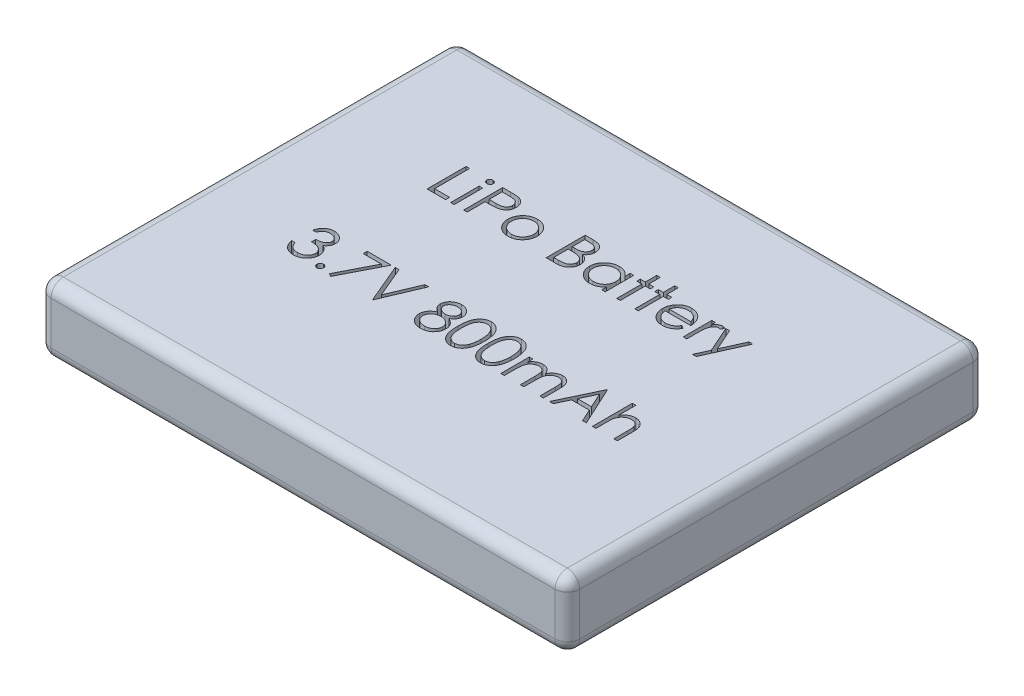
from build123d import *

# Parameters (mm, degrees)
SKETCH1_W           = 43
SKETCH1_H           = 34
BOSS_EXTRUDE1_DEPTH = 5.5
FILLET1_R           = 1
SKETCH5_W           = 0.284935897
SKETCH5_H           = 2.320192308
CUT_EXTRUDE4_DEPTH  = 1


with BuildPart() as part:
    # Sketch1 → Boss-Extrude1 (new body)
    with BuildSketch(Plane(origin=(0, 0, 0), x_dir=(1, 0, 0), z_dir=(0, 1, 0))):
        with Locations((21.5, 17)):
            Rectangle(SKETCH1_W, SKETCH1_H)
    extrude(amount=BOSS_EXTRUDE1_DEPTH)

    # Fillet1
    fillet1_edges = [part.edges().sort_by_distance(p)[0] for p in [
        (43, 5.5, -17),
        (21.5, 5.5, -34),
        (0, 5.5, -17),
        (21.5, 0, -34),
        (43, 0, -17),
        (21.5, 0, 0),
        (0, 0, -17),
        (0, 2.75, -34),
        (43, 2.75, -34),
        (43, 2.75, 0),
        (0, 2.75, 0),
        (21.5, 5.5, 0),
    ]]
    fillet(fillet1_edges, radius=FILLET1_R)

    # Sketch5 → Cut-Extrude4 (cut)
    # profile 1 of 22: a face of its own
    with BuildSketch(Plane(origin=(0, 5.5, 0), x_dir=(1, 0, 0), z_dir=(0, 1, 0))):
        Polygon((9.59375, 25.175), (9.878685897, 25.175), (9.878685897, 22.325641026), (11.099839744, 22.325641026), (11.099839744, 22), (9.59375, 22), align=None)
    # profile 2 of 22: a face of its own
    with BuildSketch(Plane(origin=(0, 5.5, 0), x_dir=(1, 0, 0), z_dir=(0, 1, 0))):
        with BuildLine():
            add(Edge.make_bspline(
                [(11.648086939, 25.297115385), (11.665768347, 25.296295189), (11.70039194, 25.294689089), (11.750460118, 25.280935463), (11.796050408, 25.257622177), (11.83648878, 25.226344181), (11.871188705, 25.189560043), (11.895482636, 25.146687593), (11.911096738, 25.100370114), (11.912982284, 25.06806214), (11.913942308, 25.05161258)],
                knots=[0, 0, 0, 0, 1.055194115, 2.066272739, 3.074728998, 4.095836921, 5.109056067, 6.073838105, 7.019297344, 8, 8, 8, 8], degree=3))
            add(Edge.make_bspline(
                [(11.913942308, 25.05161258), (11.912960634, 25.03559003), (11.911019982, 25.003915346), (11.895494696, 24.958400839), (11.870981666, 24.916124096), (11.83651103, 24.879411381), (11.796044512, 24.848150675), (11.750461684, 24.824832805), (11.700391528, 24.811080395), (11.665768208, 24.809474127), (11.648086939, 24.808653846)],
                knots=[0, 0, 0, 0, 0.96129708, 1.900370562, 2.859976407, 3.87933698, 4.906634145, 5.921202961, 6.938410037, 8, 8, 8, 8], degree=3))
            add(Edge.make_bspline(
                [(11.648086939, 24.808653846), (11.630607861, 24.809442807), (11.596587119, 24.810978415), (11.547268626, 24.825102646), (11.502067068, 24.848158655), (11.461549829, 24.879206694), (11.427776725, 24.916349565), (11.403194673, 24.958375039), (11.387705243, 25.003921915), (11.385759759, 25.035592237), (11.384775641, 25.05161258)],
                knots=[0, 0, 0, 0, 1.054934014, 2.053291228, 3.073705704, 4.106921865, 5.123545215, 6.088680038, 7.033164197, 8, 8, 8, 8], degree=3))
            add(Edge.make_bspline(
                [(11.384775641, 25.05161258), (11.385738198, 25.068059851), (11.387628721, 25.100363328), (11.403206284, 25.146713822), (11.427571966, 25.189332756), (11.461572192, 25.226548745), (11.502061117, 25.257614247), (11.547270164, 25.280665637), (11.596586713, 25.294791066), (11.630607723, 25.296326509), (11.648086939, 25.297115385)],
                knots=[0, 0, 0, 0, 0.98631895, 1.937192651, 2.907499808, 3.917963147, 4.944918757, 5.95915025, 6.951458133, 8, 8, 8, 8], degree=3))
        make_face()
    # profile 3 of 22: a face of its own
    with BuildSketch(Plane(origin=(0, 5.5, 0), x_dir=(1, 0, 0), z_dir=(0, 1, 0))):
        with Locations((11.649358975, 23.160096154)):
            Rectangle(SKETCH5_W, SKETCH5_H)
    # profile 4 of 22: a face of its own
    with BuildSketch(Plane(origin=(0, 5.5, 0), x_dir=(1, 0, 0), z_dir=(0, 1, 0))):
        with BuildLine():
            Line((12.565224359, 25.175), (13.187885617, 25.175))
            add(Edge.make_bspline(
                [(13.187885617, 25.175), (13.230712653, 25.174952923), (13.312771157, 25.17486272), (13.430441243, 25.172127915), (13.5373115, 25.16847513), (13.633151488, 25.163411556), (13.718256091, 25.157427506), (13.792240213, 25.149034585), (13.855685382, 25.140271317), (13.893700518, 25.131361898), (13.91103766, 25.127298678)],
                knots=[0, 0, 0, 0, 1.415646017, 2.712440637, 3.8905458, 4.950247383, 5.884950622, 6.709939814, 7.411656543, 8, 8, 8, 8], degree=3))
            add(Edge.make_bspline(
                [(13.91103766, 25.127298678), (13.932984652, 25.121291623), (13.976361481, 25.109419063), (14.03886457, 25.085639471), (14.098331273, 25.057443507), (14.154965615, 25.025308933), (14.208071648, 24.987857028), (14.258441699, 24.946605961), (14.305631253, 24.900603324), (14.349374944, 24.850365081), (14.389547582, 24.796734605), (14.424136651, 24.738911296), (14.453099207, 24.677868471), (14.477939746, 24.613648589), (14.49581813, 24.545712367), (14.509286389, 24.474531849), (14.517834965, 24.400114666), (14.518653718, 24.349260357), (14.519070513, 24.323372396)],
                knots=[0, 0, 0, 0, 0.999701418, 1.975846123, 2.934577507, 3.890451536, 4.834027766, 5.787354733, 6.749476667, 7.726910423, 8.712836071, 9.690891519, 10.682875813, 11.679750201, 12.712814741, 13.765529915, 14.8625177, 16, 16, 16, 16], degree=3))
            add(Edge.make_bspline(
                [(14.519070513, 24.323372396), (14.51868822, 24.297266841), (14.517940239, 24.24618956), (14.508962895, 24.171465674), (14.496870507, 24.100056849), (14.478276752, 24.032121418), (14.453923892, 23.968062827), (14.425356101, 23.906902138), (14.390899612, 23.849679864), (14.351307517, 23.796188264), (14.307264285, 23.74637713), (14.258956262, 23.700607423), (14.206578476, 23.659147059), (14.150297384, 23.62190309), (14.089564307, 23.589739179), (14.025300353, 23.560930767), (13.956946943, 23.536736305), (13.909646234, 23.524009035), (13.885596955, 23.517538061)],
                knots=[0, 0, 0, 0, 1.121902311, 2.195077645, 3.232258892, 4.234102512, 5.217864754, 6.176164875, 7.132989551, 8.084763148, 9.034132444, 9.988522005, 10.94243251, 11.903244335, 12.886203696, 13.894208494, 14.929344452, 16, 16, 16, 16], degree=3))
            add(Edge.make_bspline(
                [(13.885596955, 23.517538061), (13.865705731, 23.513308071), (13.822112956, 23.504037802), (13.750319201, 23.493688702), (13.666730172, 23.484855307), (13.571459961, 23.478232132), (13.464594083, 23.472562155), (13.346074728, 23.468055384), (13.215669244, 23.465579017), (13.124708901, 23.465451298), (13.07721855, 23.465384615)],
                knots=[0, 0, 0, 0, 0.601384939, 1.31797006, 2.144135048, 3.087295005, 4.142315834, 5.309527816, 6.595305764, 8, 8, 8, 8], degree=3))
            Line((13.07721855, 23.465384615), (12.850160256, 23.465384615))
            Line((12.850160256, 23.465384615), (12.850160256, 22))
            Line((12.850160256, 22), (12.565224359, 22))
            Line((12.565224359, 22), (12.565224359, 25.175))
        make_face()
        with BuildLine():
            Line((12.850160256, 24.849358974), (12.850160256, 23.791025641))
            Line((12.850160256, 23.791025641), (13.406039663, 23.784029447))
            add(Edge.make_bspline(
                [(13.406039663, 23.784029447), (13.43318131, 23.784015419), (13.4855777, 23.783988339), (13.561266274, 23.787603506), (13.631487556, 23.791776847), (13.69602585, 23.797887291), (13.754910247, 23.806524432), (13.808238934, 23.815243652), (13.855598398, 23.827857802), (13.911024103, 23.8448423), (13.972785425, 23.873809745), (14.039975273, 23.915855716), (14.096917162, 23.969450359), (14.146191617, 24.029709891), (14.185294806, 24.096746959), (14.213920599, 24.16847378), (14.230740077, 24.244154758), (14.23299541, 24.295941855), (14.234134615, 24.322100361)],
                knots=[0, 0, 0, 0, 1.160613943, 2.240541288, 3.23993089, 4.169200891, 5.011653406, 5.7853311, 6.478053781, 7.106038997, 8.262395093, 9.384106736, 10.481365981, 11.59014053, 12.70357646, 13.786202915, 14.881775077, 16, 16, 16, 16], degree=3))
            add(Edge.make_bspline(
                [(14.234134615, 24.322100361), (14.232989215, 24.347626012), (14.2307123, 24.398367848), (14.213788767, 24.472734295), (14.185350461, 24.543705256), (14.145929121, 24.609902269), (14.098085382, 24.669944969), (14.042478121, 24.722103078), (13.979238234, 24.764032765), (13.920411624, 24.791095813), (13.86815912, 24.80761967), (13.822772985, 24.819181061), (13.771527873, 24.82841179), (13.714407101, 24.835886196), (13.651853402, 24.842284693), (13.583329359, 24.846626258), (13.509094554, 24.849167579), (13.457559251, 24.849293631), (13.430844351, 24.849358974)],
                knots=[0, 0, 0, 0, 1.120700087, 2.227813068, 3.331159281, 4.466773991, 5.599788987, 6.693661531, 7.80175334, 8.91857717, 9.525282508, 10.207424825, 10.974604443, 11.810962634, 12.737642355, 13.736264703, 14.826523623, 16, 16, 16, 16], degree=3))
            Line((13.430844351, 24.849358974), (12.850160256, 24.849358974))
        make_face(mode=Mode.SUBTRACT)
    # profile 5 of 22: a face of its own
    with BuildSketch(Plane(origin=(0, 5.5, 0), x_dir=(1, 0, 0), z_dir=(0, 1, 0))):
        with BuildLine():
            add(Edge.make_bspline(
                [(16.209605369, 24.360897436), (16.253140309, 24.359970435), (16.338501688, 24.358152812), (16.463513127, 24.338726379), (16.582843357, 24.309019841), (16.696949403, 24.267952067), (16.8043699, 24.212904869), (16.906669528, 24.147219298), (17.003567815, 24.069402231), (17.061645849, 24.009205983), (17.091125801, 23.978650841)],
                knots=[0, 0, 0, 0, 1.054011418, 2.066658804, 3.057071809, 4.030435133, 4.997543892, 5.974964718, 6.972108034, 8, 8, 8, 8], degree=3))
            add(Edge.make_bspline(
                [(17.091125801, 23.978650841), (17.116509431, 23.949428154), (17.166785447, 23.89154832), (17.231252207, 23.797699299), (17.286788908, 23.700507922), (17.331296022, 23.598683562), (17.366388865, 23.49311511), (17.391304175, 23.383439714), (17.406124109, 23.269899585), (17.408122515, 23.19278896), (17.409134615, 23.153735978)],
                knots=[0, 0, 0, 0, 1.025258237, 2.030674902, 3.01204498, 3.988269485, 4.97094183, 5.956517959, 6.965070386, 8, 8, 8, 8], degree=3))
            add(Edge.make_bspline(
                [(17.409134615, 23.153735978), (17.408244402, 23.11445664), (17.4064853, 23.036838836), (17.389845019, 22.922521268), (17.363963248, 22.811673108), (17.326922938, 22.704758435), (17.279426653, 22.601450442), (17.221468672, 22.502200351), (17.152642277, 22.406812344), (17.074624365, 22.316096391), (16.988398735, 22.232488468), (16.894857657, 22.159619252), (16.795839355, 22.097188297), (16.690027171, 22.046899549), (16.578387379, 22.007248606), (16.460679181, 21.979399306), (16.337085439, 21.962561207), (16.25269646, 21.960398966), (16.209605369, 21.959294872)],
                knots=[0, 0, 0, 0, 0.998656419, 1.973391657, 2.932242238, 3.890759089, 4.846373663, 5.82037756, 6.809684879, 7.83454468, 8.860553229, 9.859544525, 10.845671541, 11.83227036, 12.833544569, 13.85385346, 14.904124723, 16, 16, 16, 16], degree=3))
            add(Edge.make_bspline(
                [(16.209605369, 21.959294872), (16.166303159, 21.960402671), (16.081493593, 21.962572352), (15.957463595, 21.979333887), (15.839544441, 22.007235772), (15.727758498, 22.047029854), (15.621491387, 22.097189905), (15.52189935, 22.159430509), (15.428282284, 22.232510078), (15.342038413, 22.316090535), (15.264025392, 22.406813853), (15.195197734, 22.502199959), (15.137240081, 22.601450544), (15.089743711, 22.704758408), (15.052703423, 22.811673115), (15.026821646, 22.922521266), (15.010181367, 23.036838836), (15.008422265, 23.11445664), (15.007532051, 23.153735978)],
                knots=[0, 0, 0, 0, 1.099876186, 2.154163076, 3.173186993, 4.173200201, 5.163417411, 6.152872554, 7.150605724, 8.17532212, 9.198891216, 10.186952605, 11.159729845, 12.11414092, 13.071450619, 14.029093627, 15.002601286, 16, 16, 16, 16], degree=3))
            add(Edge.make_bspline(
                [(15.007532051, 23.153735978), (15.008551054, 23.192576701), (15.010568505, 23.269474659), (15.025373538, 23.38280135), (15.050191657, 23.492291124), (15.085326567, 23.597452092), (15.130243919, 23.698830237), (15.18500023, 23.796261763), (15.250124589, 23.88968641), (15.300200645, 23.94749144), (15.325540865, 23.976742788)],
                knots=[0, 0, 0, 0, 1.031353054, 2.041901799, 3.029428768, 4.008703097, 4.981709435, 5.96992636, 6.972712378, 8, 8, 8, 8], degree=3))
            add(Edge.make_bspline(
                [(15.325540865, 23.976742788), (15.354976373, 24.007562912), (15.412866478, 24.068176108), (15.51024711, 24.145766326), (15.612295076, 24.212818764), (15.720902687, 24.266772189), (15.834914994, 24.309261415), (15.954856736, 24.33880299), (16.080292382, 24.358082819), (16.166071467, 24.35994988), (16.209605369, 24.360897436)],
                knots=[0, 0, 0, 0, 1.027980169, 2.021703884, 2.998553061, 3.971491411, 4.943284454, 5.930300938, 6.949603206, 8, 8, 8, 8], degree=3))
        make_face()
        with BuildLine():
            add(Edge.make_bspline(
                [(16.208333333, 24.075961538), (16.177547072, 24.075086516), (16.116769291, 24.07335906), (16.027307239, 24.060220089), (15.941182956, 24.039403425), (15.858233048, 24.009826888), (15.778737241, 23.971637172), (15.702619426, 23.924730303), (15.629655713, 23.869727549), (15.561273413, 23.806714983), (15.498515172, 23.737881895), (15.443653008, 23.664540884), (15.39700309, 23.587881555), (15.358140946, 23.507824192), (15.329196568, 23.423557503), (15.308175326, 23.336035787), (15.295048751, 23.245080731), (15.293337536, 23.18324895), (15.292467949, 23.151827925)],
                knots=[0, 0, 0, 0, 1.021534396, 2.016698045, 2.994645724, 3.958388632, 4.93408049, 5.916473867, 6.921342795, 7.962252576, 8.998418191, 10.008913653, 10.997312074, 11.973003931, 12.956656626, 13.948281152, 14.957379055, 16, 16, 16, 16], degree=3))
            add(Edge.make_bspline(
                [(15.292467949, 23.151827925), (15.293925567, 23.111231443), (15.296818668, 23.030655018), (15.320345632, 22.911990642), (15.359703186, 22.798069962), (15.412850218, 22.689560812), (15.479440145, 22.589165246), (15.55789627, 22.499656113), (15.64737657, 22.422380413), (15.746814395, 22.358262789), (15.854178669, 22.307317867), (15.967804046, 22.271214511), (16.086313818, 22.24774519), (16.167304196, 22.245412495), (16.208333333, 22.244230769)],
                knots=[0, 0, 0, 0, 1.016792936, 2.018143844, 3.017858371, 4.030088057, 5.03801393, 6.028138512, 7.003788237, 7.991172063, 8.984598303, 9.972568034, 10.972917682, 12, 12, 12, 12], degree=3))
            add(Edge.make_bspline(
                [(16.208333333, 22.244230769), (16.249360111, 22.245419381), (16.33034583, 22.247765666), (16.44869094, 22.27109631), (16.562005758, 22.307476059), (16.669258516, 22.358205493), (16.768651078, 22.422623898), (16.858774924, 22.499219754), (16.936561164, 22.589402319), (17.00308522, 22.689693792), (17.057102622, 22.79790174), (17.096275955, 22.912011668), (17.11985948, 23.030649663), (17.122744946, 23.111229649), (17.124198718, 23.151827925)],
                knots=[0, 0, 0, 0, 1.02726834, 2.027799167, 3.010890988, 4.004497153, 4.992059811, 5.971914811, 6.958719428, 7.966827853, 8.981595046, 9.981490638, 10.983022906, 12, 12, 12, 12], degree=3))
            add(Edge.make_bspline(
                [(17.124198718, 23.151827925), (17.12332943, 23.183249138), (17.121618804, 23.245081288), (17.108487944, 23.336033657), (17.087482561, 23.423565319), (17.058479737, 23.507795351), (17.019786453, 23.588088837), (16.972236934, 23.664315804), (16.917598789, 23.738135956), (16.854083258, 23.806492473), (16.785772337, 23.869752114), (16.712779052, 23.924751631), (16.636774107, 23.971431021), (16.55750925, 24.01015354), (16.474548707, 24.039134341), (16.388545097, 24.060340285), (16.299464748, 24.073303535), (16.238904759, 24.075069871), (16.208333333, 24.075961538)],
                knots=[0, 0, 0, 0, 1.042956736, 2.052379634, 3.044323526, 4.02829302, 5.004299113, 5.996692471, 7.007513377, 8.048758398, 9.090003419, 10.095195979, 11.07790575, 12.047570684, 13.018257071, 13.989683339, 14.985167495, 16, 16, 16, 16], degree=3))
        make_face(mode=Mode.SUBTRACT)
    # profile 6 of 22: a face of its own
    with BuildSketch(Plane(origin=(0, 5.5, 0), x_dir=(1, 0, 0), z_dir=(0, 1, 0))):
        with BuildLine():
            Line((19.281570513, 25.175), (19.901051683, 25.175))
            add(Edge.make_bspline(
                [(19.901051683, 25.175), (19.931376088, 25.174840569), (19.990152332, 25.174531553), (20.075622826, 25.169738998), (20.155677104, 25.163204241), (20.230338383, 25.152835514), (20.299572163, 25.140324401), (20.363587091, 25.125173468), (20.422179605, 25.107006469), (20.492131873, 25.078117342), (20.571888472, 25.035188468), (20.658247014, 24.97175327), (20.732092289, 24.894163107), (20.795761305, 24.806639555), (20.846380892, 24.710359248), (20.883001612, 24.607616984), (20.906186256, 24.499737975), (20.908570621, 24.425675949), (20.909775641, 24.388246194)],
                knots=[0, 0, 0, 0, 1.001505555, 1.941167018, 2.826882275, 3.653841531, 4.429895133, 5.150066043, 5.825578002, 6.45369114, 7.647487171, 8.808567382, 9.977351308, 11.170798116, 12.373658725, 13.556498008, 14.765093433, 16, 16, 16, 16], degree=3))
            add(Edge.make_bspline(
                [(20.909775641, 24.388246194), (20.908783936, 24.353182804), (20.906835141, 24.284279937), (20.888199924, 24.183501709), (20.859025603, 24.087570246), (20.818471556, 23.996835654), (20.765764745, 23.913348019), (20.703300413, 23.836433856), (20.627937885, 23.769349683), (20.571474374, 23.731845764), (20.54279347, 23.712795473)],
                knots=[0, 0, 0, 0, 1.044552857, 2.05264487, 3.044412934, 4.028983338, 5.005914585, 5.980388656, 6.974128949, 8, 8, 8, 8], degree=3))
            add(Edge.make_bspline(
                [(20.54279347, 23.712795473), (20.578861857, 23.698947938), (20.647869618, 23.672454174), (20.742834787, 23.625613431), (20.824654396, 23.574666374), (20.893957521, 23.519029624), (20.953228108, 23.459059489), (21.004983277, 23.393876635), (21.049144238, 23.322630762), (21.086983818, 23.246064698), (21.11651019, 23.164960259), (21.138622617, 23.080078197), (21.151293089, 22.991722887), (21.153096164, 22.931592578), (21.15400641, 22.901236979)],
                knots=[0, 0, 0, 0, 1.27268992, 2.434971085, 3.483601985, 4.442670788, 5.356604649, 6.2567628, 7.179492994, 8.113709626, 9.066344395, 10.018646069, 10.999752585, 12, 12, 12, 12], degree=3))
            add(Edge.make_bspline(
                [(21.15400641, 22.901236979), (21.153120271, 22.870242745), (21.151376768, 22.809260721), (21.138513508, 22.719675707), (21.116733818, 22.634064148), (21.086733564, 22.551872304), (21.047579179, 22.473259182), (20.999928811, 22.398135721), (20.943113035, 22.327256721), (20.879556004, 22.259834577), (20.807653915, 22.199212227), (20.730078909, 22.145222979), (20.645854033, 22.100821908), (20.556362581, 22.063523803), (20.460600666, 22.035032987), (20.358998301, 22.015100724), (20.251643113, 22.00167044), (20.177974267, 22.000566261), (20.140194311, 22)],
                knots=[0, 0, 0, 0, 0.978564426, 1.925352924, 2.850884081, 3.763762016, 4.682927383, 5.618979971, 6.567305752, 7.547517671, 8.540179244, 9.531824382, 10.526200242, 11.540722885, 12.589160233, 13.674978461, 14.80764778, 16, 16, 16, 16], degree=3))
            Line((20.140194311, 22), (19.281570513, 22))
            Line((19.281570513, 22), (19.281570513, 25.175))
        make_face()
        with BuildLine():
            Line((19.56650641, 24.849358974), (19.56650641, 23.831730769))
            Line((19.56650641, 23.831730769), (19.757947716, 23.831730769))
            add(Edge.make_bspline(
                [(19.757947716, 23.831730769), (19.785931981, 23.832093557), (19.840003282, 23.832794536), (19.91830776, 23.834802512), (19.990992598, 23.840425023), (20.057932332, 23.846045917), (20.119021549, 23.855185008), (20.174124909, 23.866063576), (20.224107208, 23.877568783), (20.281746653, 23.897135389), (20.347127113, 23.926052994), (20.416825715, 23.970931017), (20.478270555, 24.024383823), (20.530156575, 24.086061339), (20.572621266, 24.153975664), (20.602115851, 24.227043192), (20.622115887, 24.303442883), (20.623922491, 24.355892298), (20.624839744, 24.382522035)],
                knots=[0, 0, 0, 0, 1.156816544, 2.235205308, 3.236616184, 4.169592532, 5.011045266, 5.787822928, 6.49130361, 7.128639758, 8.301311294, 9.436451833, 10.541879658, 11.654887649, 12.756523258, 13.837046038, 14.901820046, 16, 16, 16, 16], degree=3))
            add(Edge.make_bspline(
                [(20.624839744, 24.382522035), (20.624362423, 24.400143985), (20.623426107, 24.434711364), (20.615757753, 24.485102564), (20.602724311, 24.532495111), (20.585983631, 24.577538482), (20.562589606, 24.618824232), (20.535045607, 24.657779845), (20.501766445, 24.693078696), (20.463886597, 24.726071026), (20.420335918, 24.755321419), (20.371140389, 24.780939826), (20.315634425, 24.801568959), (20.254753478, 24.819635755), (20.18756042, 24.832325136), (20.114830646, 24.842896423), (20.035968437, 24.848278267), (19.981408237, 24.848990704), (19.953205128, 24.849358974)],
                knots=[0, 0, 0, 0, 0.91205012, 1.789085906, 2.630437955, 3.453916878, 4.269457761, 5.079663411, 5.91843418, 6.774407191, 7.675494373, 8.627863946, 9.638891023, 10.736472738, 11.911756761, 13.175263542, 14.539845004, 16, 16, 16, 16], degree=3))
            Line((19.953205128, 24.849358974), (19.56650641, 24.849358974))
        make_face(mode=Mode.SUBTRACT)
        with BuildLine():
            Line((19.56650641, 23.506089744), (19.56650641, 22.325641026))
            Line((19.56650641, 22.325641026), (19.972285657, 22.325641026))
            add(Edge.make_bspline(
                [(19.972285657, 22.325641026), (20.001331397, 22.325989139), (20.057313232, 22.326660083), (20.138140776, 22.328850429), (20.213055449, 22.333832707), (20.2817154, 22.341675728), (20.344862025, 22.350183321), (20.401737799, 22.361623555), (20.452803767, 22.374730826), (20.512016889, 22.394991111), (20.578695072, 22.426465766), (20.650550634, 22.473922243), (20.714437275, 22.530458387), (20.768689189, 22.59589143), (20.813150971, 22.667039848), (20.845495563, 22.742464559), (20.865444411, 22.820919287), (20.867859379, 22.874410519), (20.869070513, 22.901236979)],
                knots=[0, 0, 0, 0, 1.160039823, 2.235823828, 3.228722157, 4.157150951, 4.99529583, 5.772374946, 6.472645482, 7.099169577, 8.269452708, 9.405989375, 10.527446681, 11.663510218, 12.788923519, 13.866172445, 14.929861265, 16, 16, 16, 16], degree=3))
            add(Edge.make_bspline(
                [(20.869070513, 22.901236979), (20.868820047, 22.918013081), (20.868323155, 22.951294684), (20.860829597, 23.000204035), (20.849931301, 23.047580363), (20.835842071, 23.093552313), (20.815322983, 23.137288733), (20.791368475, 23.179654626), (20.76328206, 23.220705997), (20.71951771, 23.272605684), (20.655861695, 23.332401831), (20.565413406, 23.390946565), (20.462568536, 23.438161362), (20.387976453, 23.458208744), (20.349444111, 23.468564704)],
                knots=[0, 0, 0, 0, 0.723448775, 1.435228256, 2.130040452, 2.821711965, 3.505591119, 4.210454504, 4.921174351, 5.648778258, 7.137944449, 8.670945889, 10.280296675, 12, 12, 12, 12], degree=3))
            add(Edge.make_bspline(
                [(20.349444111, 23.468564704), (20.333996288, 23.471698958), (20.300502222, 23.478494669), (20.245885345, 23.485668086), (20.183532093, 23.492058961), (20.113298483, 23.496786226), (20.035095656, 23.50167259), (19.948756594, 23.503572892), (19.854633887, 23.505840078), (19.78932652, 23.506004393), (19.755403646, 23.506089744)],
                knots=[0, 0, 0, 0, 0.634451884, 1.375622551, 2.216452059, 3.157844607, 4.20941857, 5.370758133, 6.634282058, 8, 8, 8, 8], degree=3))
            Line((19.755403646, 23.506089744), (19.56650641, 23.506089744))
        make_face(mode=Mode.SUBTRACT)
    # profile 7 of 22: a face of its own
    with BuildSketch(Plane(origin=(0, 5.5, 0), x_dir=(1, 0, 0), z_dir=(0, 1, 0))):
        with BuildLine():
            Line((24.084775641, 24.320192308), (24.084775641, 22))
            Line((24.084775641, 22), (23.799839744, 22))
            Line((23.799839744, 22), (23.799839744, 22.401327123))
            add(Edge.make_bspline(
                [(23.799839744, 22.401327123), (23.767709841, 22.365005492), (23.705007931, 22.294123371), (23.600286345, 22.201520257), (23.489280927, 22.124977066), (23.372530443, 22.063155356), (23.250140322, 22.016716848), (23.122381871, 21.983709404), (22.989202976, 21.962487853), (22.898259768, 21.960368748), (22.852173478, 21.959294872)],
                knots=[0, 0, 0, 0, 1.074387032, 2.096679803, 3.090159297, 4.057316773, 5.018401886, 5.985159533, 6.978961417, 8, 8, 8, 8], degree=3))
            add(Edge.make_bspline(
                [(22.852173478, 21.959294872), (22.811199691, 21.960407367), (22.730397569, 21.962601256), (22.611535478, 21.979621345), (22.497151794, 22.006954124), (22.387138432, 22.044964216), (22.282207272, 22.095383962), (22.181459898, 22.155746379), (22.085418242, 22.227629132), (21.995546203, 22.309805415), (21.912785745, 22.399063725), (21.840158734, 22.494264328), (21.779604154, 22.594995561), (21.728967367, 22.699982065), (21.68996354, 22.810032028), (21.662773172, 22.924764887), (21.645772909, 23.044044987), (21.643579927, 23.125270126), (21.642467949, 23.16645633)],
                knots=[0, 0, 0, 0, 1.033919861, 2.038935746, 3.024066025, 3.998881131, 4.97069526, 5.957263378, 6.95902576, 7.993208707, 9.027059324, 10.027763471, 11.009749337, 11.988697705, 12.965288445, 13.950418724, 14.960734635, 16, 16, 16, 16], degree=3))
            add(Edge.make_bspline(
                [(21.642467949, 23.16645633), (21.643604573, 23.206791261), (21.645851617, 23.286531244), (21.662591324, 23.403805492), (21.690740882, 23.516761342), (21.730245001, 23.625035141), (21.780901631, 23.728757901), (21.84252211, 23.82800298), (21.915110887, 23.923043791), (21.998797, 24.011645547), (22.089452112, 24.093488533), (22.186433604, 24.164616738), (22.287329009, 24.226045594), (22.393703312, 24.274716962), (22.503982042, 24.314095221), (22.619146954, 24.341339413), (22.738718886, 24.357393412), (22.819899547, 24.359718205), (22.861077724, 24.360897436)],
                knots=[0, 0, 0, 0, 1.020392517, 2.01726096, 2.990465484, 3.961182959, 4.928053699, 5.906110375, 6.912531644, 7.948652711, 8.985773172, 9.998621852, 10.987621588, 11.969261332, 12.953316658, 13.946091881, 14.958173133, 16, 16, 16, 16], degree=3))
            add(Edge.make_bspline(
                [(22.861077724, 24.360897436), (22.908430454, 24.35959319), (23.001286921, 24.357035625), (23.137111615, 24.335751579), (23.265603391, 24.299793827), (23.387754125, 24.250882954), (23.503125176, 24.185887321), (23.610624312, 24.103899785), (23.711376572, 24.005437423), (23.769778693, 23.929808519), (23.799839744, 23.890880409)],
                knots=[0, 0, 0, 0, 1.038897134, 2.037228247, 3.008116434, 3.962042015, 4.918381754, 5.904844433, 6.921570401, 8, 8, 8, 8], degree=3))
            Line((23.799839744, 23.890880409), (23.799839744, 24.320192308))
            Line((23.799839744, 24.320192308), (24.084775641, 24.320192308))
        make_face()
        with BuildLine():
            add(Edge.make_bspline(
                [(22.86489383, 24.075961538), (22.823242966, 24.074479596), (22.741030787, 24.071554476), (22.62034087, 24.04871852), (22.504849416, 24.010723209), (22.395134049, 23.958760342), (22.292927881, 23.893419988), (22.201584337, 23.814388447), (22.120356315, 23.723822013), (22.052040961, 23.622129384), (21.99635101, 23.513110687), (21.957192345, 23.399151376), (21.931366671, 23.28230686), (21.928728227, 23.203056424), (21.927403846, 23.163276242)],
                knots=[0, 0, 0, 0, 1.031046209, 2.035121221, 3.029706178, 4.034933723, 5.034054252, 6.02443088, 7.017295772, 8.038157696, 9.050218397, 10.03989886, 11.016116709, 12, 12, 12, 12], degree=3))
            add(Edge.make_bspline(
                [(21.927403846, 23.163276242), (21.929095571, 23.123733788), (21.932472389, 23.044803872), (21.95673909, 22.927800063), (21.997451547, 22.813813896), (22.053006847, 22.703812852), (22.122572571, 22.60168299), (22.203207277, 22.509390164), (22.295690746, 22.430024609), (22.398132128, 22.363587667), (22.507540787, 22.309918809), (22.622597282, 22.272575693), (22.741138753, 22.248465849), (22.821740513, 22.245649645), (22.86234976, 22.244230769)],
                knots=[0, 0, 0, 0, 0.979072187, 1.954306742, 2.945804271, 3.96968567, 4.997920485, 5.998718438, 6.996577872, 8.005894225, 9.015743152, 10.005417472, 10.995077863, 12, 12, 12, 12], degree=3))
            add(Edge.make_bspline(
                [(22.86234976, 22.244230769), (22.90357623, 22.245736594), (22.985571591, 22.248731529), (23.106619561, 22.271665248), (23.224089992, 22.309555515), (23.336382692, 22.362078295), (23.440990897, 22.427172467), (23.534878257, 22.5033789), (23.614267743, 22.592009646), (23.681571038, 22.689415428), (23.734344452, 22.796197025), (23.772785592, 22.909893041), (23.795513063, 23.030507434), (23.798377575, 23.112933996), (23.799839744, 23.155008013)],
                knots=[0, 0, 0, 0, 1.01762866, 2.023962475, 3.030623092, 4.058876274, 5.077231937, 6.066672613, 7.034107872, 8.005628644, 8.981990164, 9.965428785, 10.961468474, 12, 12, 12, 12], degree=3))
            add(Edge.make_bspline(
                [(23.799839744, 23.155008013), (23.798969198, 23.187064473), (23.797255689, 23.250161732), (23.784165101, 23.34280598), (23.763341704, 23.431464432), (23.733999107, 23.5162303), (23.695453441, 23.596634921), (23.648964397, 23.673255618), (23.593714453, 23.745693888), (23.530593007, 23.812952245), (23.461500288, 23.874299107), (23.388389526, 23.929058097), (23.31039452, 23.974042198), (23.228826922, 24.011272494), (23.143545211, 24.040899009), (23.053855435, 24.06066356), (22.960710925, 24.074234708), (22.897169146, 24.075379868), (22.86489383, 24.075961538)],
                knots=[0, 0, 0, 0, 1.050140795, 2.067009409, 3.05949893, 4.030605086, 5.00011959, 5.97591094, 6.962425594, 7.979863591, 8.993523472, 9.986985069, 10.967611495, 11.937549037, 12.921786183, 13.919465291, 14.943216303, 16, 16, 16, 16], degree=3))
        make_face(mode=Mode.SUBTRACT)
    # profile 8 of 22: a face of its own
    with BuildSketch(Plane(origin=(0, 5.5, 0), x_dir=(1, 0, 0), z_dir=(0, 1, 0))):
        Polygon((25.02099359, 25.256410256), (25.305929487, 25.256410256), (25.305929487, 24.320192308), (25.712980769, 24.320192308), (25.712980769, 24.03525641), (25.305929487, 24.03525641), (25.305929487, 22), (25.02099359, 22), (25.02099359, 24.03525641), (24.613942308, 24.03525641), (24.613942308, 24.320192308), (25.02099359, 24.320192308), align=None)
    # profile 9 of 22: a face of its own
    with BuildSketch(Plane(origin=(0, 5.5, 0), x_dir=(1, 0, 0), z_dir=(0, 1, 0))):
        Polygon((26.486378205, 25.256410256), (26.771314103, 25.256410256), (26.771314103, 24.320192308), (27.178365385, 24.320192308), (27.178365385, 24.03525641), (26.771314103, 24.03525641), (26.771314103, 22), (26.486378205, 22), (26.486378205, 24.03525641), (26.079326923, 24.03525641), (26.079326923, 24.320192308), (26.486378205, 24.320192308), align=None)
    # profile 10 of 22: a face of its own
    with BuildSketch(Plane(origin=(0, 5.5, 0), x_dir=(1, 0, 0), z_dir=(0, 1, 0))):
        with BuildLine():
            Line((29.571063702, 22.732692308), (29.824198718, 22.599764623))
            add(Edge.make_bspline(
                [(29.824198718, 22.599764623), (29.804026949, 22.563983887), (29.764780676, 22.494368744), (29.697288569, 22.398726985), (29.626538617, 22.312686557), (29.549337161, 22.238546085), (29.467993952, 22.1739109), (29.382057901, 22.117361587), (29.291081616, 22.069175501), (29.195060794, 22.028578565), (29.093189059, 21.997364238), (28.98521954, 21.975316838), (28.870945398, 21.961688587), (28.792617078, 21.960105495), (28.752509014, 21.959294872)],
                knots=[0, 0, 0, 0, 1.120438281, 2.179929193, 3.190490725, 4.156257408, 5.095198341, 6.022838206, 6.959905092, 7.901321166, 8.864066838, 9.862729781, 10.905609505, 12, 12, 12, 12], degree=3))
            add(Edge.make_bspline(
                [(28.752509014, 21.959294872), (28.707930221, 21.960335524), (28.620969908, 21.962365534), (28.494387423, 21.979866555), (28.375207522, 22.008416481), (28.263436906, 22.048299508), (28.159349291, 22.100394295), (28.062737801, 22.163857539), (27.973094374, 22.238363227), (27.893243841, 22.324556715), (27.821358319, 22.416796776), (27.757925611, 22.5129139), (27.70489637, 22.612666254), (27.661759359, 22.7154188), (27.626920661, 22.820523904), (27.602639436, 22.928937878), (27.588642451, 23.040367301), (27.586497561, 23.115748455), (27.585416667, 23.153735978)],
                knots=[0, 0, 0, 0, 1.145258523, 2.234067595, 3.276747158, 4.290159414, 5.277019952, 6.260822364, 7.254936242, 8.264827045, 9.274100331, 10.257902744, 11.220704747, 12.172965371, 13.118907548, 14.062713208, 15.023725156, 16, 16, 16, 16], degree=3))
            add(Edge.make_bspline(
                [(27.585416667, 23.153735978), (27.586377459, 23.189382002), (27.588281623, 23.260027716), (27.600283837, 23.364590031), (27.621554789, 23.466215842), (27.650743311, 23.564989591), (27.688436227, 23.660745898), (27.734548312, 23.753543042), (27.789151398, 23.843282276), (27.831308752, 23.899890833), (27.852544071, 23.928405449)],
                knots=[0, 0, 0, 0, 1.024358464, 2.0301432, 3.019427413, 4.004406732, 4.986367066, 5.972626655, 6.978780325, 8, 8, 8, 8], degree=3))
            add(Edge.make_bspline(
                [(27.852544071, 23.928405449), (27.881307468, 23.962757924), (27.937923113, 24.030374674), (28.033677807, 24.119218727), (28.137364413, 24.193644152), (28.247683531, 24.25533634), (28.365917333, 24.302211719), (28.490476475, 24.337143598), (28.622779257, 24.356717936), (28.713226136, 24.359482757), (28.759505208, 24.360897436)],
                knots=[0, 0, 0, 0, 1.030682036, 2.02871468, 2.997146059, 3.962720338, 4.930598197, 5.918074684, 6.934738563, 8, 8, 8, 8], degree=3))
            add(Edge.make_bspline(
                [(28.759505208, 24.360897436), (28.807082679, 24.35966912), (28.900418831, 24.357259445), (29.036519397, 24.334919842), (29.165298047, 24.299493596), (29.286703248, 24.249461229), (29.400747307, 24.18490935), (29.506688938, 24.104952108), (29.606339953, 24.012044272), (29.664314164, 23.940594789), (29.693815104, 23.904236779)],
                knots=[0, 0, 0, 0, 1.056321875, 2.072262726, 3.055038591, 4.01806755, 4.982017516, 5.957941055, 6.960871419, 8, 8, 8, 8], degree=3))
            add(Edge.make_bspline(
                [(29.693815104, 23.904236779), (29.713887398, 23.876837816), (29.753898379, 23.822222265), (29.804015391, 23.733167001), (29.8475196, 23.639993819), (29.882293071, 23.541196621), (29.910450333, 23.437946002), (29.930821876, 23.329503836), (29.942768601, 23.215902417), (29.94511692, 23.138499042), (29.946314103, 23.099038462)],
                knots=[0, 0, 0, 0, 0.94817472, 1.890038105, 2.849395472, 3.817997239, 4.812318967, 5.836947057, 6.897266129, 8, 8, 8, 8], degree=3))
            Line((29.946314103, 23.099038462), (27.870352564, 23.099038462))
            add(Edge.make_bspline(
                [(27.870352564, 23.099038462), (27.871749207, 23.068467326), (27.874495649, 23.008350421), (27.8873001, 22.920384068), (27.907482917, 22.836588251), (27.935848423, 22.757591491), (27.970199062, 22.682362018), (28.012277533, 22.611457885), (28.062478414, 22.545202048), (28.118472442, 22.483001859), (28.180799592, 22.427611026), (28.24637037, 22.378034057), (28.316123819, 22.336481837), (28.389509937, 22.302754366), (28.466410057, 22.276350779), (28.546848405, 22.258327828), (28.630666696, 22.246256381), (28.687803755, 22.244914113), (28.716892027, 22.244230769)],
                knots=[0, 0, 0, 0, 1.094153842, 2.151609401, 3.174256925, 4.172055639, 5.149267565, 6.128595816, 7.11444997, 8.118368179, 9.117203808, 10.09244225, 11.054858984, 12.015122123, 12.976791628, 13.957293641, 14.960065497, 16, 16, 16, 16], degree=3))
            add(Edge.make_bspline(
                [(28.716892027, 22.244230769), (28.745331997, 22.244782363), (28.801762352, 22.245876832), (28.885800844, 22.256519351), (28.968477415, 22.273728102), (29.049449879, 22.297214021), (29.127074861, 22.325858737), (29.198961895, 22.360423472), (29.265074662, 22.398659314), (29.326866482, 22.442392376), (29.386802312, 22.495921231), (29.44625871, 22.56271935), (29.510009674, 22.641720179), (29.549914519, 22.701179461), (29.571063702, 22.732692308)],
                knots=[0, 0, 0, 0, 0.99110716, 1.966546729, 2.947904876, 3.932708344, 4.903319531, 5.828989031, 6.710028674, 7.56322171, 8.463672341, 9.504779593, 10.677557249, 12, 12, 12, 12], degree=3))
        make_face()
        with BuildLine():
            add(Edge.make_bspline(
                [(29.661378205, 23.383974359), (29.650949124, 23.421768537), (29.630876501, 23.494510165), (29.588933513, 23.595240115), (29.541697187, 23.68476414), (29.485797473, 23.762397092), (29.422461915, 23.831343136), (29.349305214, 23.891594282), (29.267266939, 23.945494398), (29.176771147, 23.990989879), (29.080938956, 24.02971568), (28.980603339, 24.055682749), (28.878225203, 24.073471405), (28.808979101, 24.075127947), (28.774133614, 24.075961538)],
                knots=[0, 0, 0, 0, 1.154881502, 2.222775134, 3.210006277, 4.132804581, 5.035138423, 5.962687519, 6.919655026, 7.923214229, 8.944639381, 9.960483929, 10.97369054, 12, 12, 12, 12], degree=3))
            add(Edge.make_bspline(
                [(28.774133614, 24.075961538), (28.745695195, 24.075406665), (28.689478419, 24.074309797), (28.606655307, 24.063904751), (28.527117294, 24.046705463), (28.450277498, 24.023151538), (28.377142853, 23.991756592), (28.306209027, 23.954941807), (28.239279668, 23.910000514), (28.197422921, 23.875747838), (28.176277043, 23.85844351)],
                knots=[0, 0, 0, 0, 1.04873581, 2.073130211, 3.073294108, 4.04793562, 5.032784715, 6.005352987, 6.992311501, 8, 8, 8, 8], degree=3))
            add(Edge.make_bspline(
                [(28.176277043, 23.85844351), (28.161133852, 23.844750809), (28.130487723, 23.81704012), (28.089538821, 23.769297911), (28.050331678, 23.717816137), (28.014650436, 23.660625203), (27.981922911, 23.598376353), (27.951297789, 23.531594641), (27.923732972, 23.459773302), (27.908224358, 23.409724017), (27.900245393, 23.383974359)],
                knots=[0, 0, 0, 0, 0.879870761, 1.780643979, 2.707998968, 3.669668524, 4.684282772, 5.740141944, 6.837334558, 8, 8, 8, 8], degree=3))
            Line((27.900245393, 23.383974359), (29.661378205, 23.383974359))
        make_face(mode=Mode.SUBTRACT)
    # profile 11 of 22: a face of its own
    with BuildSketch(Plane(origin=(0, 5.5, 0), x_dir=(1, 0, 0), z_dir=(0, 1, 0))):
        with BuildLine():
            Line((30.434775641, 24.320192308), (30.719711538, 24.320192308))
            Line((30.719711538, 24.320192308), (30.719711538, 23.978650841))
            add(Edge.make_bspline(
                [(30.719711538, 23.978650841), (30.740747055, 24.010451486), (30.780977318, 24.071269971), (30.847845475, 24.151705694), (30.916337783, 24.218303629), (30.986782131, 24.271374678), (31.059696551, 24.311119436), (31.133480785, 24.340232403), (31.209295676, 24.357447539), (31.260242564, 24.35974593), (31.285767228, 24.360897436)],
                knots=[0, 0, 0, 0, 1.2804753, 2.448899062, 3.506932113, 4.484331642, 5.4025378, 6.288909075, 7.142734305, 8, 8, 8, 8], degree=3))
            add(Edge.make_bspline(
                [(31.285767228, 24.360897436), (31.305566824, 24.359817458), (31.34630578, 24.357595334), (31.4079757, 24.341982657), (31.471515117, 24.317056165), (31.512465712, 24.293615392), (31.533814103, 24.281395232)],
                knots=[0, 0, 0, 0, 0.901110191, 1.854092781, 2.881294221, 4, 4, 4, 4], degree=3))
            Line((31.533814103, 24.281395232), (31.377353766, 24.034620393))
            add(Edge.make_bspline(
                [(31.377353766, 24.034620393), (31.363647725, 24.040734777), (31.337631037, 24.052341049), (31.299572251, 24.066077015), (31.264482753, 24.074165024), (31.242127525, 24.075390318), (31.231705729, 24.075961538)],
                knots=[0, 0, 0, 0, 1.180555205, 2.24091978, 3.179933427, 4, 4, 4, 4], degree=3))
            add(Edge.make_bspline(
                [(31.231705729, 24.075961538), (31.208840528, 24.074437505), (31.162202146, 24.071328917), (31.093726921, 24.04689157), (31.027281242, 24.007407959), (30.974511234, 23.963619165), (30.933651476, 23.921393663), (30.9044957, 23.884519755), (30.877750637, 23.843173425), (30.852196223, 23.798061498), (30.828913227, 23.748413709), (30.80718292, 23.694726079), (30.787535237, 23.636936427), (30.776331801, 23.596675141), (30.770592949, 23.576051683)],
                knots=[0, 0, 0, 0, 1.125678352, 2.296057538, 3.5422874, 4.923748041, 5.663163013, 6.437101912, 7.23742474, 8.08941207, 8.991984279, 9.93940061, 10.944477711, 12, 12, 12, 12], degree=3))
            add(Edge.make_bspline(
                [(30.770592949, 23.576051683), (30.766299992, 23.55765739), (30.756791419, 23.516915428), (30.747546238, 23.448563552), (30.738411747, 23.367806376), (30.7319741, 23.274419109), (30.726006876, 23.168634964), (30.722641301, 23.050292785), (30.71982631, 22.919271102), (30.719750956, 22.827672938), (30.719711538, 22.779757612)],
                knots=[0, 0, 0, 0, 0.566838948, 1.255505196, 2.06880316, 3.007127437, 4.065329342, 5.249902469, 6.561414163, 8, 8, 8, 8], degree=3))
            Line((30.719711538, 22.779757612), (30.719711538, 22))
            Line((30.719711538, 22), (30.434775641, 22))
            Line((30.434775641, 22), (30.434775641, 24.320192308))
        make_face()
    # profile 12 of 22: a face of its own
    with BuildSketch(Plane(origin=(0, 5.5, 0), x_dir=(1, 0, 0), z_dir=(0, 1, 0))):
        Polygon((31.574519231, 24.320192308), (31.881715745, 24.320192308), (32.667197516, 22.543159054), (33.464763622, 24.320192308), (33.772596154, 24.320192308), (32.347916667, 21.145192308), (32.040084135, 21.145192308), (32.512645232, 22.197801482), align=None)
    # profile 13 of 22: a face of its own
    with BuildSketch(Plane(origin=(0, 5.5, 0), x_dir=(1, 0, 0), z_dir=(0, 1, 0))):
        with BuildLine():
            Line((8.128365385, 14.442307692), (7.843429487, 14.442307692))
            add(Edge.make_bspline(
                [(7.843429487, 14.442307692), (7.851148865, 14.474268588), (7.866239618, 14.536749526), (7.897715274, 14.62601897), (7.932004598, 14.710495307), (7.973179, 14.788596746), (8.018090513, 14.861892893), (8.069546125, 14.928721313), (8.125171873, 14.990781646), (8.186698791, 15.045857226), (8.251222649, 15.09572988), (8.319652625, 15.138252254), (8.390611965, 15.174832021), (8.464592307, 15.204967517), (8.541813905, 15.227669242), (8.621578635, 15.244140059), (8.704095524, 15.254836284), (8.76010941, 15.25588019), (8.788551683, 15.256410256)],
                knots=[0, 0, 0, 0, 1.162005537, 2.271625781, 3.343758855, 4.383309926, 5.390229558, 6.379919256, 7.361854164, 8.333198761, 9.295911338, 10.242430842, 11.177959212, 12.116337295, 13.062827104, 14.020064771, 14.994644689, 16, 16, 16, 16], degree=3))
            add(Edge.make_bspline(
                [(8.788551683, 15.256410256), (8.829992456, 15.255159098), (8.911970059, 15.252684071), (9.032405108, 15.230083118), (9.148543723, 15.194318891), (9.259114683, 15.144903438), (9.361819976, 15.083954947), (9.453202088, 15.011415507), (9.53202238, 14.928684712), (9.598147994, 14.837305886), (9.649923172, 14.73964696), (9.688101525, 14.639135389), (9.71134405, 14.5360096), (9.714356269, 14.466379783), (9.715865385, 14.431495393)],
                knots=[0, 0, 0, 0, 1.083050992, 2.142477498, 3.193116406, 4.255571735, 5.30263384, 6.308962982, 7.297363603, 8.282367274, 9.249857812, 10.179914175, 11.08814088, 12, 12, 12, 12], degree=3))
            add(Edge.make_bspline(
                [(9.715865385, 14.431495393), (9.714809841, 14.397924943), (9.712744307, 14.332232783), (9.695205874, 14.236328282), (9.665690835, 14.145939116), (9.624806122, 14.060684776), (9.571882002, 13.981105814), (9.50777177, 13.907023185), (9.432022926, 13.838108306), (9.37461989, 13.798629927), (9.345067107, 13.778305288)],
                knots=[0, 0, 0, 0, 1.024540389, 2.004866551, 2.965041327, 3.920577974, 4.882998113, 5.874504559, 6.905732034, 8, 8, 8, 8], degree=3))
            add(Edge.make_bspline(
                [(9.345067107, 13.778305288), (9.378841628, 13.761996519), (9.445758721, 13.729684128), (9.536972415, 13.666314977), (9.619774488, 13.593148148), (9.665951433, 13.53605017), (9.689152644, 13.507361779)],
                knots=[0, 0, 0, 0, 1.015518401, 2.012035669, 3.001164323, 4, 4, 4, 4], degree=3))
            add(Edge.make_bspline(
                [(9.689152644, 13.507361779), (9.704430148, 13.486445104), (9.734734975, 13.44495428), (9.772141495, 13.378246236), (9.806076906, 13.310798814), (9.832520319, 13.24080421), (9.852998041, 13.16907369), (9.867635727, 13.095484088), (9.876729055, 13.019975311), (9.878031306, 12.968891847), (9.878685897, 12.943214143)],
                knots=[0, 0, 0, 0, 1.025084078, 2.033381695, 3.024893161, 4.013698104, 4.991890475, 5.976764909, 6.982997093, 8, 8, 8, 8], degree=3))
            add(Edge.make_bspline(
                [(9.878685897, 12.943214143), (9.877058017, 12.898755324), (9.873809918, 12.810046911), (9.84477765, 12.678987699), (9.799771354, 12.550875994), (9.735856847, 12.428343818), (9.65796275, 12.313698758), (9.565291463, 12.211122392), (9.458895936, 12.122949372), (9.340236525, 12.049280094), (9.211678845, 11.990390265), (9.074178129, 11.949516727), (8.92971558, 11.922895713), (8.83064896, 11.920041054), (8.780283454, 11.918589744)],
                knots=[0, 0, 0, 0, 0.955779014, 1.907060117, 2.875433937, 3.871313158, 4.872415639, 5.851225146, 6.836215519, 7.83643374, 8.849228613, 9.86973379, 10.916971861, 12, 12, 12, 12], degree=3))
            add(Edge.make_bspline(
                [(8.780283454, 11.918589744), (8.746338803, 11.919377337), (8.679547049, 11.920927058), (8.581354732, 11.931521218), (8.487627191, 11.95087058), (8.398237698, 11.976908578), (8.313106844, 12.009921087), (8.232494406, 12.05103162), (8.155904431, 12.099392769), (8.084059668, 12.155575381), (8.016968682, 12.218423453), (7.956414425, 12.289052698), (7.901387327, 12.366157486), (7.85336079, 12.450633401), (7.810147269, 12.541388741), (7.774604544, 12.639585593), (7.743321207, 12.744346099), (7.728776564, 12.817350906), (7.721314103, 12.854807692)],
                knots=[0, 0, 0, 0, 1.048658725, 2.063410685, 3.046034179, 4.001477787, 4.936774919, 5.862367409, 6.792675028, 7.730719943, 8.675894397, 9.627829632, 10.600096036, 11.597688215, 12.626045268, 13.701542398, 14.82072376, 16, 16, 16, 16], degree=3))
            Line((7.721314103, 12.854807692), (8.00625, 12.854807692))
            add(Edge.make_bspline(
                [(8.00625, 12.854807692), (8.013673414, 12.830361087), (8.0281126, 12.782810317), (8.052690999, 12.714375183), (8.080692932, 12.651638949), (8.110732567, 12.594141403), (8.142281586, 12.541316295), (8.177582982, 12.494560456), (8.214022135, 12.451820237), (8.241489834, 12.427740482), (8.254932893, 12.415955529)],
                knots=[0, 0, 0, 0, 1.198163088, 2.33053128, 3.407730985, 4.417276592, 5.372219308, 6.28897303, 7.162600585, 8, 8, 8, 8], degree=3))
            add(Edge.make_bspline(
                [(8.254932893, 12.415955529), (8.272709787, 12.402250112), (8.308208703, 12.374881583), (8.366055598, 12.339955106), (8.42689303, 12.30969189), (8.492039199, 12.286574537), (8.560088312, 12.267000516), (8.632140279, 12.254191188), (8.707559426, 12.245402633), (8.759055897, 12.244627088), (8.785371595, 12.244230769)],
                knots=[0, 0, 0, 0, 0.946170439, 1.889420265, 2.845303464, 3.807233317, 4.801018734, 5.828864929, 6.890507805, 8, 8, 8, 8], degree=3))
            add(Edge.make_bspline(
                [(8.785371595, 12.244230769), (8.815083701, 12.244789483), (8.873183159, 12.245882), (8.957960067, 12.255929249), (9.038611823, 12.270561838), (9.114242977, 12.293161472), (9.185844223, 12.321084102), (9.252411862, 12.356143727), (9.314819759, 12.397277867), (9.372268576, 12.444031247), (9.423926287, 12.495213603), (9.469409988, 12.548746889), (9.508076645, 12.604405392), (9.539267463, 12.662497116), (9.56389689, 12.722781502), (9.580663794, 12.785427726), (9.592321954, 12.849923103), (9.593271381, 12.893764382), (9.59375, 12.915865385)],
                knots=[0, 0, 0, 0, 1.217147791, 2.380027433, 3.494444702, 4.572153297, 5.609568379, 6.639424714, 7.649109417, 8.668170816, 9.669597737, 10.625200337, 11.543417969, 12.441394052, 13.322311151, 14.205496177, 15.095365482, 16, 16, 16, 16], degree=3))
            add(Edge.make_bspline(
                [(9.59375, 12.915865385), (9.592361798, 12.945448528), (9.589592301, 13.004467612), (9.56844809, 13.091297126), (9.533669263, 13.174956936), (9.484980628, 13.254019688), (9.425711788, 13.327294971), (9.356437908, 13.392674101), (9.27658373, 13.446621969), (9.203087134, 13.483895251), (9.137985885, 13.509328883), (9.082273358, 13.526269744), (9.019901296, 13.540614988), (8.951623966, 13.55396112), (8.876926905, 13.565319772), (8.795891436, 13.574791991), (8.708501138, 13.582371206), (8.648002723, 13.585755843), (8.616826923, 13.5875)],
                knots=[0, 0, 0, 0, 1.07054697, 2.135767047, 3.216561865, 4.33974944, 5.486079747, 6.621378074, 7.775625952, 8.963672916, 9.598146892, 10.304877434, 11.070270905, 11.915000392, 12.823868403, 13.805723172, 14.86925407, 16, 16, 16, 16], degree=3))
            Line((8.616826923, 13.5875), (8.616826923, 13.913141026))
            add(Edge.make_bspline(
                [(8.616826923, 13.913141026), (8.656107266, 13.913807598), (8.733047809, 13.915113248), (8.845437643, 13.930904801), (8.952909862, 13.95274937), (9.053082692, 13.986209509), (9.144385453, 14.025071778), (9.223596807, 14.070294854), (9.289607005, 14.120563948), (9.342095262, 14.176654958), (9.381582491, 14.23681218), (9.410453943, 14.299510862), (9.427508525, 14.365300546), (9.429785151, 14.41019928), (9.430929487, 14.432767428)],
                knots=[0, 0, 0, 0, 1.321986639, 2.589447074, 3.816329219, 5.01088745, 6.139805852, 7.153945165, 8.075214402, 8.924034688, 9.728124013, 10.488707548, 11.240355623, 12, 12, 12, 12], degree=3))
            add(Edge.make_bspline(
                [(9.430929487, 14.432767428), (9.430553557, 14.449347954), (9.429805662, 14.482334124), (9.420373846, 14.53052615), (9.406200609, 14.577244866), (9.386715426, 14.622291594), (9.360634889, 14.665353913), (9.329423744, 14.706798956), (9.292259824, 14.746390099), (9.249673597, 14.78329296), (9.203942888, 14.818462197), (9.15382345, 14.848319567), (9.100826463, 14.873851159), (9.044893255, 14.894905493), (8.98584231, 14.910743562), (8.923951075, 14.922115361), (8.859101534, 14.929225234), (8.814858605, 14.930248868), (8.792367788, 14.930769231)],
                knots=[0, 0, 0, 0, 0.884392785, 1.759457502, 2.611959086, 3.489218968, 4.37281399, 5.2945488, 6.255912374, 7.266815255, 8.301784654, 9.332968512, 10.37626691, 11.440494194, 12.520033166, 13.637162961, 14.798855837, 16, 16, 16, 16], degree=3))
            add(Edge.make_bspline(
                [(8.792367788, 14.930769231), (8.756216632, 14.929507067), (8.685605017, 14.927041767), (8.583810056, 14.905449033), (8.489177518, 14.870997486), (8.416843156, 14.829873961), (8.363428249, 14.789278925), (8.325258455, 14.753825617), (8.28777485, 14.714425841), (8.253443414, 14.668652887), (8.21872345, 14.619606584), (8.187114454, 14.564793673), (8.156398876, 14.505643972), (8.137890849, 14.463828647), (8.128365385, 14.442307692)],
                knots=[0, 0, 0, 0, 1.472543308, 2.876219568, 4.221790263, 5.565193594, 6.249813518, 6.953379497, 7.687249741, 8.463570142, 9.283606569, 10.136032583, 11.040678096, 12, 12, 12, 12], degree=3))
        make_face()
    # profile 14 of 22: a face of its own
    with BuildSketch(Plane(origin=(0, 5.5, 0), x_dir=(1, 0, 0), z_dir=(0, 1, 0))):
        with BuildLine():
            add(Edge.make_bspline(
                [(10.672435897, 12.488461538), (10.690116304, 12.487410916), (10.724776675, 12.485351293), (10.774886455, 12.471221025), (10.820238754, 12.446130668), (10.860635862, 12.412690862), (10.89393388, 12.372145511), (10.919918399, 12.327154936), (10.933925578, 12.276625635), (10.935970198, 12.241764429), (10.937019231, 12.223878205)],
                knots=[0, 0, 0, 0, 1.020151414, 1.999887582, 2.974338812, 3.990962822, 5.007586832, 5.987933904, 6.967670073, 8, 8, 8, 8], degree=3))
            add(Edge.make_bspline(
                [(10.937019231, 12.223878205), (10.93593465, 12.206421756), (10.933795873, 12.171997895), (10.919950507, 12.121849711), (10.893735847, 12.076831019), (10.860865532, 12.035735508), (10.820228767, 12.002224861), (10.774779235, 11.97734797), (10.724894308, 11.962205959), (10.690135929, 11.960277104), (10.672435897, 11.959294872)],
                knots=[0, 0, 0, 0, 1.009421747, 1.99056486, 2.972319754, 3.999869655, 5.017953583, 5.993804169, 6.978383603, 8, 8, 8, 8], degree=3))
            add(Edge.make_bspline(
                [(10.672435897, 11.959294872), (10.654723112, 11.960241564), (10.620143114, 11.962089754), (10.57044439, 11.977658871), (10.524718069, 12.001991581), (10.484089216, 12.035797992), (10.450943603, 12.076619551), (10.425883434, 12.122159752), (10.410833799, 12.171854341), (10.408854529, 12.206393482), (10.407852564, 12.223878205)],
                knots=[0, 0, 0, 0, 1.022052826, 1.995314843, 2.982371812, 4.00089066, 5.028879526, 6.005146991, 6.990147033, 8, 8, 8, 8], degree=3))
            add(Edge.make_bspline(
                [(10.407852564, 12.223878205), (10.40881604, 12.241793714), (10.410697108, 12.276771546), (10.425915028, 12.326845022), (10.450749163, 12.372354963), (10.484318343, 12.412629004), (10.52470824, 12.4463632), (10.570334083, 12.470914834), (10.620262809, 12.485465779), (10.654743253, 12.487445633), (10.672435897, 12.488461538)],
                knots=[0, 0, 0, 0, 1.032775665, 2.016367738, 2.991239715, 4.008302682, 5.025365648, 6.011011707, 6.979408107, 8, 8, 8, 8], degree=3))
        make_face()
    # profile 15 of 22: a face of its own
    with BuildSketch(Plane(origin=(0, 5.5, 0), x_dir=(1, 0, 0), z_dir=(0, 1, 0))):
        Polygon((11.547596154, 15.175), (13.501442308, 15.175), (11.832532051, 11.918589744), (11.586393229, 12.054061498), (13.019340946, 14.849358974), (11.547596154, 14.849358974), align=None)
    # profile 16 of 22: a face of its own
    with BuildSketch(Plane(origin=(0, 5.5, 0), x_dir=(1, 0, 0), z_dir=(0, 1, 0))):
        Polygon((13.827083333, 15.175), (14.132371795, 15.175), (15.190705128, 12.672906651), (16.249038462, 15.175), (16.554326923, 15.175), (15.211057692, 12), (15.170352564, 12), align=None)
    # profile 17 of 22: a face of its own
    with BuildSketch(Plane(origin=(0, 5.5, 0), x_dir=(1, 0, 0), z_dir=(0, 1, 0))):
        with BuildLine():
            add(Edge.make_bspline(
                [(19.60403145, 13.768765024), (19.630019775, 13.755214164), (19.680705688, 13.728785461), (19.752893584, 13.686230639), (19.818865549, 13.641380621), (19.880451988, 13.596353806), (19.936570884, 13.549425808), (19.986594745, 13.500410016), (20.031759229, 13.450529908), (20.071153525, 13.398940839), (20.105803513, 13.345779865), (20.135750236, 13.290907453), (20.16134727, 13.234443857), (20.18163365, 13.175772733), (20.198344847, 13.115755924), (20.209843431, 13.053618469), (20.216027349, 12.989769817), (20.217196487, 12.946618572), (20.217788462, 12.924769631)],
                knots=[0, 0, 0, 0, 1.272397273, 2.481599622, 3.635517121, 4.734568067, 5.792894095, 6.808321871, 7.773003508, 8.711915296, 9.623354172, 10.525449501, 11.423591555, 12.311487226, 13.218079475, 14.126165749, 15.051214107, 16, 16, 16, 16], degree=3))
            add(Edge.make_bspline(
                [(20.217788462, 12.924769631), (20.217088673, 12.894200974), (20.215703529, 12.833694131), (20.203638543, 12.744389444), (20.185574627, 12.657655899), (20.159195355, 12.573512511), (20.124983922, 12.492423579), (20.082822792, 12.414319692), (20.035096913, 12.337920747), (19.996768096, 12.290913147), (19.977373798, 12.267127404)],
                knots=[0, 0, 0, 0, 1.025265484, 2.029385089, 3.018602448, 3.995076438, 4.983346944, 5.966715145, 6.97116228, 8, 8, 8, 8], degree=3))
            add(Edge.make_bspline(
                [(19.977373798, 12.267127404), (19.952122139, 12.23937448), (19.901930863, 12.184211583), (19.815949208, 12.11259192), (19.721586499, 12.052403541), (19.619207868, 12.003352608), (19.509086984, 11.965174722), (19.391247308, 11.937740438), (19.265459112, 11.92202652), (19.179003435, 11.919755043), (19.134650441, 11.918589744)],
                knots=[0, 0, 0, 0, 0.954267603, 1.896743057, 2.838368354, 3.796610408, 4.779680527, 5.799409237, 6.871065594, 8, 8, 8, 8], degree=3))
            add(Edge.make_bspline(
                [(19.134650441, 11.918589744), (19.092002581, 11.919635206), (19.009014178, 11.921669569), (18.88822096, 11.935453089), (18.775623604, 11.959608368), (18.670567419, 11.992668835), (18.573685747, 12.035676685), (18.485254648, 12.089205742), (18.403998259, 12.151101407), (18.332382529, 12.223141321), (18.268802298, 12.300300962), (18.212951278, 12.379904208), (18.166529079, 12.461958325), (18.127225214, 12.545239815), (18.097137079, 12.63091597), (18.076298002, 12.718545981), (18.06306341, 12.80797679), (18.061302524, 12.868330504), (18.060416667, 12.898692909)],
                knots=[0, 0, 0, 0, 1.256902934, 2.445805442, 3.576955095, 4.645999104, 5.686449165, 6.692658513, 7.68621702, 8.689161843, 9.678783111, 10.630372946, 11.551080876, 12.453998257, 13.34127905, 14.221779781, 15.105423033, 16, 16, 16, 16], degree=3))
            add(Edge.make_bspline(
                [(18.060416667, 12.898692909), (18.060940887, 12.920971604), (18.061976932, 12.96500217), (18.069147759, 13.030052775), (18.080676149, 13.09336784), (18.096332942, 13.155181229), (18.117551944, 13.215042927), (18.143171594, 13.273236571), (18.173045579, 13.32982786), (18.207590636, 13.385126274), (18.247778901, 13.438356974), (18.293284497, 13.490423341), (18.345016921, 13.540517463), (18.402400654, 13.589251377), (18.464779915, 13.637489582), (18.533774961, 13.682625136), (18.607556761, 13.727853432), (18.659994522, 13.754893842), (18.68689403, 13.768765024)],
                knots=[0, 0, 0, 0, 0.941657376, 1.861047343, 2.762797495, 3.66048619, 4.553285746, 5.444104102, 6.34607688, 7.256116206, 8.197091036, 9.162375105, 10.176350973, 11.237807142, 12.343728897, 13.50695164, 14.721116704, 16, 16, 16, 16], degree=3))
            add(Edge.make_bspline(
                [(18.68689403, 13.768765024), (18.650071855, 13.788844421), (18.578773816, 13.827723755), (18.484367966, 13.899158357), (18.403277901, 13.976526589), (18.33773255, 14.061462189), (18.286141314, 14.151311853), (18.250745866, 14.245513425), (18.226800484, 14.342320185), (18.224428462, 14.408456521), (18.223237179, 14.441671675)],
                knots=[0, 0, 0, 0, 1.166880483, 2.259407225, 3.286803203, 4.280235371, 5.237608625, 6.161067461, 7.076446754, 8, 8, 8, 8], degree=3))
            add(Edge.make_bspline(
                [(18.223237179, 14.441671675), (18.224720743, 14.475505888), (18.227702964, 14.543518558), (18.251817833, 14.644761256), (18.291115322, 14.74419914), (18.344565084, 14.841350251), (18.411137773, 14.932926517), (18.491008568, 15.01506009), (18.58227013, 15.087006935), (18.684466909, 15.147401034), (18.794445494, 15.196553353), (18.91048333, 15.230460922), (19.030558648, 15.252627971), (19.112290151, 15.255137722), (19.15373097, 15.256410256)],
                knots=[0, 0, 0, 0, 0.888701115, 1.786444228, 2.72001202, 3.692817113, 4.693886446, 5.687152267, 6.695133018, 7.739871481, 8.800368666, 9.853104506, 10.91144658, 12, 12, 12, 12], degree=3))
            add(Edge.make_bspline(
                [(19.15373097, 15.256410256), (19.194102287, 15.255098217), (19.273709927, 15.252511024), (19.390726482, 15.230932927), (19.502690478, 15.194892577), (19.609215809, 15.146000096), (19.708395432, 15.085777657), (19.796027527, 15.012842578), (19.873436369, 14.931071314), (19.937466498, 14.839522817), (19.990228548, 14.742745013), (20.026968651, 14.64148744), (20.050510799, 14.537937937), (20.053480208, 14.467872033), (20.054967949, 14.432767428)],
                knots=[0, 0, 0, 0, 1.072916533, 2.115669174, 3.151510826, 4.193348718, 5.225979165, 6.227137561, 7.216255879, 8.211077061, 9.189680878, 10.138522389, 11.067357538, 12, 12, 12, 12], degree=3))
            add(Edge.make_bspline(
                [(20.054967949, 14.432767428), (20.053666597, 14.398317169), (20.051110817, 14.330658817), (20.029611586, 14.232028331), (19.993404509, 14.139661195), (19.943970518, 14.052509303), (19.879540254, 13.97215323), (19.800973761, 13.897571147), (19.70889742, 13.828150381), (19.639717902, 13.788974179), (19.60403145, 13.768765024)],
                knots=[0, 0, 0, 0, 0.975232327, 1.915300861, 2.843280834, 3.77672583, 4.742871857, 5.749627742, 6.839139064, 8, 8, 8, 8], degree=3))
        make_face()
        with BuildLine():
            add(Edge.make_bspline(
                [(19.137830529, 14.930769231), (19.115559441, 14.930178281), (19.071987454, 14.929022125), (19.008098588, 14.92298179), (18.947345084, 14.911231372), (18.889092179, 14.895593398), (18.834138542, 14.874467866), (18.781737839, 14.849616679), (18.732781888, 14.81940332), (18.686679706, 14.785511376), (18.645177218, 14.74823424), (18.608343089, 14.70939608), (18.577746871, 14.668234118), (18.551765293, 14.625772248), (18.532913488, 14.580750226), (18.518794441, 14.534548373), (18.509250036, 14.486582846), (18.508534853, 14.453801868), (18.508173077, 14.437219551)],
                knots=[0, 0, 0, 0, 1.203892937, 2.355340988, 3.463153438, 4.544400666, 5.610487187, 6.640501085, 7.674077295, 8.714426146, 9.728707835, 10.68524104, 11.601827946, 12.495867327, 13.368432065, 14.231010473, 15.105153427, 16, 16, 16, 16], degree=3))
            add(Edge.make_bspline(
                [(18.508173077, 14.437219551), (18.508796617, 14.420636518), (18.510028821, 14.387866061), (18.519558473, 14.33947374), (18.533761477, 14.291919826), (18.556123149, 14.246335071), (18.58294406, 14.201138167), (18.616047041, 14.157458707), (18.655497802, 14.115144679), (18.699972695, 14.074555986), (18.74842459, 14.036547822), (18.7997544, 14.00355215), (18.853317913, 13.975944064), (18.90856479, 13.952966676), (18.966058095, 13.93510509), (19.025445539, 13.922433532), (19.086737102, 13.914557721), (19.128266629, 13.913616994), (19.149278846, 13.913141026)],
                knots=[0, 0, 0, 0, 0.873023192, 1.725219244, 2.590779336, 3.480155217, 4.391973325, 5.357036234, 6.360879153, 7.436073238, 8.526419356, 9.601555421, 10.645666583, 11.697338044, 12.750135903, 13.812665442, 14.89329948, 16, 16, 16, 16], degree=3))
            add(Edge.make_bspline(
                [(19.149278846, 13.913141026), (19.17626644, 13.913932841), (19.229975074, 13.915508651), (19.309149896, 13.930160072), (19.386132438, 13.953206869), (19.460099872, 13.984739124), (19.529137603, 14.024315826), (19.590678237, 14.071698635), (19.644196847, 14.125793466), (19.689137257, 14.185758181), (19.723980475, 14.249577122), (19.751105687, 14.313621673), (19.766945503, 14.378575126), (19.769011582, 14.422088014), (19.770032051, 14.443579728)],
                knots=[0, 0, 0, 0, 1.076279235, 2.141928126, 3.20205304, 4.278698113, 5.344010996, 6.36967002, 7.368914609, 8.37248503, 9.349703398, 10.264243087, 11.142681841, 12, 12, 12, 12], degree=3))
            add(Edge.make_bspline(
                [(19.770032051, 14.443579728), (19.769549544, 14.458663732), (19.768591837, 14.488603317), (19.760699643, 14.532815977), (19.747658709, 14.576022814), (19.730002915, 14.61858076), (19.706771172, 14.659892709), (19.679226517, 14.700608082), (19.645767005, 14.739810953), (19.608214526, 14.778414915), (19.565628334, 14.814141851), (19.518090499, 14.845560481), (19.46584474, 14.87224169), (19.408889821, 14.893912204), (19.347435497, 14.910188478), (19.281764818, 14.922377165), (19.211330212, 14.929247059), (19.162861795, 14.930250835), (19.137830529, 14.930769231)],
                knots=[0, 0, 0, 0, 0.814439003, 1.616544685, 2.417341072, 3.248991801, 4.09997495, 4.973547432, 5.9003056, 6.880240646, 7.880314356, 8.896779544, 9.951930927, 11.043077905, 12.18215768, 13.381699519, 14.647792085, 16, 16, 16, 16], degree=3))
        make_face(mode=Mode.SUBTRACT)
        with BuildLine():
            add(Edge.make_bspline(
                [(19.15627504, 13.5875), (19.128039506, 13.586997768), (19.072648278, 13.586012512), (18.991498064, 13.575045608), (18.913616979, 13.559778944), (18.839267608, 13.536618826), (18.768481348, 13.506504867), (18.700875001, 13.470278535), (18.636965762, 13.427456454), (18.577636146, 13.378582667), (18.523458554, 13.325914448), (18.47592581, 13.270159511), (18.435560202, 13.212354071), (18.403054325, 13.151763977), (18.376373682, 13.089672216), (18.358853236, 13.024532469), (18.347621255, 12.957597016), (18.346113011, 12.912094641), (18.345352564, 12.889152644)],
                knots=[0, 0, 0, 0, 1.140299081, 2.23698856, 3.303958914, 4.344563908, 5.37730929, 6.408454204, 7.439741482, 8.480804886, 9.510774543, 10.48932336, 11.43758569, 12.353841022, 13.263987381, 14.161954604, 15.073269652, 16, 16, 16, 16], degree=3))
            add(Edge.make_bspline(
                [(18.345352564, 12.889152644), (18.346589235, 12.860640322), (18.34904276, 12.804072542), (18.368506996, 12.72046747), (18.399744947, 12.639531227), (18.443310678, 12.561923384), (18.497256262, 12.489397217), (18.563592415, 12.426179542), (18.638196603, 12.370007915), (18.723593085, 12.324577716), (18.816873194, 12.288296669), (18.918012119, 12.263299475), (19.025558367, 12.246751874), (19.099816711, 12.245084381), (19.137830529, 12.244230769)],
                knots=[0, 0, 0, 0, 0.898778495, 1.783155532, 2.693654817, 3.627872908, 4.583023416, 5.533784346, 6.509005473, 7.520592997, 8.575161974, 9.658835044, 10.801527049, 12, 12, 12, 12], degree=3))
            add(Edge.make_bspline(
                [(19.137830529, 12.244230769), (19.167539791, 12.244801188), (19.225422961, 12.245912548), (19.309865215, 12.255722657), (19.38955277, 12.271279817), (19.464331094, 12.293907176), (19.535037291, 12.321529655), (19.600472548, 12.357064329), (19.662320212, 12.397479651), (19.717532666, 12.44542955), (19.767818506, 12.49666452), (19.811663707, 12.550902631), (19.8497252, 12.606669811), (19.879598281, 12.665226322), (19.903479954, 12.725448738), (19.920646322, 12.78789238), (19.931238317, 12.85274877), (19.932309558, 12.896744356), (19.932852564, 12.919045473)],
                knots=[0, 0, 0, 0, 1.224942928, 2.386581632, 3.501229538, 4.569074225, 5.605009692, 6.626002462, 7.634866581, 8.645888296, 9.63523824, 10.59253846, 11.518950513, 12.414518923, 13.29783783, 14.186679152, 15.080837789, 16, 16, 16, 16], degree=3))
            add(Edge.make_bspline(
                [(19.932852564, 12.919045473), (19.93203083, 12.940705632), (19.930410514, 12.983415682), (19.920126516, 13.046703888), (19.90205997, 13.107847869), (19.877270117, 13.167583232), (19.844267387, 13.224699623), (19.805400969, 13.280685007), (19.758507018, 13.333985496), (19.705518449, 13.38501509), (19.647770677, 13.432200794), (19.58638691, 13.473942463), (19.521839648, 13.509096169), (19.454265478, 13.537686133), (19.383814446, 13.560171909), (19.310538368, 13.57587999), (19.234351454, 13.585767487), (19.182594535, 13.586915971), (19.15627504, 13.5875)],
                knots=[0, 0, 0, 0, 0.917430815, 1.809013306, 2.70690318, 3.612392954, 4.541220862, 5.495268465, 6.494511384, 7.542276156, 8.608045339, 9.649016899, 10.681629292, 11.715607085, 12.752076957, 13.808767841, 14.885711793, 16, 16, 16, 16], degree=3))
        make_face(mode=Mode.SUBTRACT)
    # profile 18 of 22: a face of its own
    with BuildSketch(Plane(origin=(0, 5.5, 0), x_dir=(1, 0, 0), z_dir=(0, 1, 0))):
        with BuildLine():
            add(Edge.make_bspline(
                [(20.502724359, 13.586227965), (20.503021918, 13.637116309), (20.503599932, 13.735967652), (20.510030142, 13.880008006), (20.52071206, 14.015136268), (20.535350962, 14.141358907), (20.553165416, 14.258708507), (20.576946607, 14.366871466), (20.603991078, 14.466348394), (20.635335082, 14.557463681), (20.670702577, 14.641444883), (20.709196513, 14.719844887), (20.752344577, 14.792545069), (20.797680776, 14.860705779), (20.847040299, 14.923211273), (20.899018487, 14.98094426), (20.955644046, 15.032570441), (21.014992061, 15.079602444), (21.077599854, 15.120831607), (21.141682844, 15.15714702), (21.207682118, 15.188171185), (21.27577787, 15.212564652), (21.345358047, 15.232713063), (21.416665886, 15.246491609), (21.489819124, 15.25516109), (21.539196211, 15.255989917), (21.56423778, 15.256410256)],
                knots=[0, 0, 0, 0, 1.646270934, 3.197905019, 4.663502075, 6.030701355, 7.308322542, 8.50163776, 9.611534131, 10.641858119, 11.616356847, 12.558055219, 13.465016945, 14.349605745, 15.204443733, 16.039544428, 16.859896111, 17.680448484, 18.487036065, 19.28249412, 20.06191084, 20.843045899, 21.620316918, 22.403196591, 23.190181807, 24, 24, 24, 24], degree=3))
            add(Edge.make_bspline(
                [(21.56423778, 15.256410256), (21.589488536, 15.255967738), (21.639704344, 15.255087709), (21.713945256, 15.246629561), (21.786471039, 15.232595043), (21.856972493, 15.212709587), (21.926028731, 15.188039223), (21.993099615, 15.157117338), (22.058601753, 15.121122937), (22.121494228, 15.07882842), (22.182467486, 15.031673069), (22.240023853, 14.978366934), (22.294168566, 14.91944826), (22.345581165, 14.855547427), (22.392803028, 14.785438814), (22.437773213, 14.7103418), (22.478024988, 14.628943087), (22.516791444, 14.542600805), (22.55025321, 14.448925915), (22.580430447, 14.348446454), (22.604813511, 14.239975584), (22.62512378, 14.124082419), (22.640858078, 14.000341345), (22.652317689, 13.869017616), (22.658371131, 13.730024833), (22.659511138, 13.634994498), (22.660096154, 13.586227965)],
                knots=[0, 0, 0, 0, 0.810914788, 1.612654377, 2.396697861, 3.181598691, 3.963628158, 4.749916497, 5.551656086, 6.361998678, 7.18212741, 8.025565596, 8.878627764, 9.750805457, 10.657531673, 11.591944965, 12.560506719, 13.57287815, 14.630710178, 15.753379473, 16.941251878, 18.199788006, 19.531962791, 20.947069417, 22.433333509, 24, 24, 24, 24], degree=3))
            add(Edge.make_bspline(
                [(22.660096154, 13.586227965), (22.659505074, 13.537674134), (22.658353378, 13.443068975), (22.652385551, 13.30470159), (22.640630221, 13.174074794), (22.625925446, 13.050875303), (22.605559215, 12.935615891), (22.580517386, 12.827897713), (22.552713165, 12.727255591), (22.518391601, 12.634514012), (22.480826171, 12.548379235), (22.439954672, 12.467945464), (22.396167044, 12.392501756), (22.34846154, 12.322651986), (22.297613086, 12.257901347), (22.242533378, 12.199392789), (22.184775061, 12.145716537), (22.12362237, 12.097953989), (22.059749034, 12.056148487), (21.994471871, 12.018761637), (21.926632659, 11.988614835), (21.857768766, 11.962729477), (21.786895177, 11.942953353), (21.714100237, 11.929279212), (21.639754223, 11.919689035), (21.589497089, 11.918957443), (21.56423778, 11.918589744)],
                knots=[0, 0, 0, 0, 1.561518951, 3.042555995, 4.452378317, 5.7783523, 7.031515105, 8.214008947, 9.334062868, 10.386615937, 11.391082383, 12.354592575, 13.286541444, 14.194233754, 15.072674879, 15.931287219, 16.775624067, 17.606195743, 18.42308326, 19.229000347, 20.022332153, 20.807536673, 21.593273796, 22.3848459, 23.188221202, 24, 24, 24, 24], degree=3))
            add(Edge.make_bspline(
                [(21.56423778, 11.918589744), (21.539196906, 11.919012795), (21.489821188, 11.919846969), (21.416657917, 11.928477282), (21.345644557, 11.942352489), (21.276430687, 11.961780408), (21.208661206, 11.98556101), (21.143259574, 12.01654328), (21.079498604, 12.052224899), (21.017548407, 12.092860746), (20.958573089, 12.139416844), (20.902240783, 12.190910163), (20.849966659, 12.248625686), (20.801312872, 12.311652088), (20.755072092, 12.379409529), (20.712536732, 12.452823125), (20.673193171, 12.531601779), (20.637230862, 12.616254455), (20.605346003, 12.708016425), (20.577181296, 12.807937466), (20.554943453, 12.916899507), (20.535908915, 13.034027404), (20.520556082, 13.15982447), (20.510074659, 13.294358997), (20.503596466, 13.437547151), (20.503020366, 13.535763303), (20.502724359, 13.586227965)],
                knots=[0, 0, 0, 0, 0.810891512, 1.598919785, 2.382837074, 3.152667961, 3.926044502, 4.706494248, 5.493654104, 6.291793342, 7.103789334, 7.925228297, 8.761435821, 9.622817696, 10.50288917, 11.416980706, 12.369136599, 13.353924996, 14.394355917, 15.514179734, 16.714354668, 17.994756427, 19.357759367, 20.818452758, 22.365282078, 24, 24, 24, 24], degree=3))
        make_face()
        with BuildLine():
            add(Edge.make_bspline(
                [(20.787660256, 13.5875), (20.787768612, 13.545092252), (20.787978909, 13.46278714), (20.793472748, 13.343186467), (20.800956887, 13.231634812), (20.810610064, 13.127990532), (20.824945596, 13.03260445), (20.841008182, 12.944820523), (20.860555377, 12.865103315), (20.883683001, 12.792905801), (20.91002561, 12.727002717), (20.938787358, 12.665678758), (20.969685299, 12.608209501), (21.004264814, 12.555111156), (21.041924907, 12.506210565), (21.081814935, 12.46064221), (21.125423637, 12.420004948), (21.185752032, 12.371267015), (21.265395976, 12.32090323), (21.365744532, 12.27704642), (21.468858056, 12.249485191), (21.538845261, 12.245980213), (21.573778045, 12.244230769)],
                knots=[0, 0, 0, 0, 1.459021318, 2.831673884, 4.118529203, 5.306027144, 6.411944654, 7.436330062, 8.375795394, 9.233974572, 10.042671642, 10.816086306, 11.563610507, 12.285937304, 12.993564865, 13.685989202, 14.367179055, 15.041617293, 16.353048772, 17.594441528, 18.799311195, 20, 20, 20, 20], degree=3))
            add(Edge.make_bspline(
                [(21.573778045, 12.244230769), (21.60893679, 12.245680185), (21.67918169, 12.248576023), (21.781810204, 12.276514878), (21.881441949, 12.318669388), (21.959521495, 12.368514626), (22.018923517, 12.415983896), (22.061483929, 12.456455755), (22.100547359, 12.501772864), (22.137596955, 12.550667225), (22.171577688, 12.604072978), (22.20247782, 12.661733315), (22.230674857, 12.723808354), (22.246739492, 12.767142332), (22.254952925, 12.789297877)],
                knots=[0, 0, 0, 0, 1.353760809, 2.704726607, 4.075137775, 5.516104923, 6.260822281, 7.007110065, 7.778089737, 8.566572457, 9.372053459, 10.217411131, 11.088608312, 12, 12, 12, 12], degree=3))
            add(Edge.make_bspline(
                [(22.254952925, 12.789297877), (22.264524885, 12.817627712), (22.283960071, 12.875149426), (22.309007895, 12.964379311), (22.328734078, 13.057998961), (22.346480846, 13.155448888), (22.358593975, 13.25744776), (22.368343777, 13.36367998), (22.374086615, 13.474225644), (22.374798496, 13.549332529), (22.375160256, 13.5875)],
                knots=[0, 0, 0, 0, 0.884706709, 1.796334032, 2.740027952, 3.714592787, 4.726048262, 5.777819803, 6.87074269, 8, 8, 8, 8], degree=3))
            add(Edge.make_bspline(
                [(22.375160256, 13.5875), (22.374661156, 13.625661298), (22.373684809, 13.700312955), (22.369952835, 13.809640161), (22.360315735, 13.913478773), (22.349612249, 14.01227613), (22.333830484, 14.105485333), (22.316814473, 14.193886682), (22.293953374, 14.276384997), (22.269533292, 14.354271903), (22.241583862, 14.426662497), (22.210817446, 14.493894289), (22.177959136, 14.556291861), (22.142270104, 14.613684015), (22.10417402, 14.666327822), (22.062665386, 14.713167775), (22.019390705, 14.755655596), (21.958777972, 14.804153784), (21.879426295, 14.853603679), (21.780687743, 14.89911119), (21.677935087, 14.925244427), (21.608472025, 14.928928957), (21.573778045, 14.930769231)],
                knots=[0, 0, 0, 0, 1.31362396, 2.569729283, 3.763502607, 4.902122613, 5.988968491, 7.01645872, 7.998833611, 8.933434873, 9.825090667, 10.667526885, 11.477055099, 12.250526234, 12.991942729, 13.710640831, 14.402115721, 15.076753259, 16.378508321, 17.609869233, 18.806226677, 20, 20, 20, 20], degree=3))
            add(Edge.make_bspline(
                [(21.573778045, 14.930769231), (21.538662008, 14.928926418), (21.468365961, 14.925237437), (21.364545316, 14.899208557), (21.265027797, 14.853839652), (21.185885956, 14.80399), (21.125230949, 14.756511674), (21.08252022, 14.715339677), (21.042473335, 14.670303432), (21.005581922, 14.620953123), (20.971029501, 14.567916683), (20.939296725, 14.510776875), (20.910706004, 14.449244137), (20.884322175, 14.383370657), (20.861124003, 14.311179371), (20.841988765, 14.231560356), (20.824311224, 14.144055639), (20.811796944, 14.048152943), (20.800671966, 13.944482704), (20.793522457, 13.832652565), (20.787960531, 13.712851306), (20.787762353, 13.630120641), (20.787660256, 13.5875)],
                knots=[0, 0, 0, 0, 1.207732386, 2.417664972, 3.655092373, 4.956220595, 5.625982001, 6.301752483, 6.994047911, 7.697131622, 8.419323945, 9.170223765, 9.943494443, 10.752040957, 11.610060368, 12.549350801, 13.567764191, 14.679664412, 15.874934091, 17.154273443, 18.533957287, 20, 20, 20, 20], degree=3))
        make_face(mode=Mode.SUBTRACT)
    # profile 19 of 22: a face of its own
    with BuildSketch(Plane(origin=(0, 5.5, 0), x_dir=(1, 0, 0), z_dir=(0, 1, 0))):
        with BuildLine():
            add(Edge.make_bspline(
                [(22.945032051, 13.586227965), (22.945329611, 13.637116309), (22.945907624, 13.735967652), (22.952337834, 13.880008006), (22.963019752, 14.015136268), (22.977658655, 14.141358907), (22.995473108, 14.258708507), (23.019254299, 14.366871466), (23.04629877, 14.466348394), (23.077642775, 14.557463681), (23.113010269, 14.641444883), (23.151504206, 14.719844887), (23.194652269, 14.792545069), (23.239988469, 14.860705779), (23.289347991, 14.923211273), (23.341326179, 14.98094426), (23.397951739, 15.032570441), (23.457299753, 15.079602444), (23.519907546, 15.120831607), (23.583990536, 15.15714702), (23.64998981, 15.188171185), (23.718085562, 15.212564652), (23.78766574, 15.232713063), (23.858973579, 15.246491609), (23.932126816, 15.25516109), (23.981503903, 15.255989917), (24.006545473, 15.256410256)],
                knots=[0, 0, 0, 0, 1.646270934, 3.197905019, 4.663502075, 6.030701355, 7.308322542, 8.50163776, 9.611534131, 10.641858119, 11.616356847, 12.558055219, 13.465016945, 14.349605745, 15.204443733, 16.039544428, 16.859896111, 17.680448484, 18.487036065, 19.28249412, 20.06191084, 20.843045899, 21.620316918, 22.403196591, 23.190181807, 24, 24, 24, 24], degree=3))
            add(Edge.make_bspline(
                [(24.006545473, 15.256410256), (24.031796228, 15.255967738), (24.082012036, 15.255087709), (24.156252948, 15.246629561), (24.228778731, 15.232595043), (24.299280185, 15.212709587), (24.368336423, 15.188039223), (24.435407307, 15.157117338), (24.500909445, 15.121122937), (24.56380192, 15.07882842), (24.624775179, 15.031673069), (24.682331545, 14.978366934), (24.736476259, 14.91944826), (24.787888857, 14.855547427), (24.83511072, 14.785438814), (24.880080905, 14.7103418), (24.920332681, 14.628943087), (24.959099136, 14.542600805), (24.992560903, 14.448925915), (25.022738139, 14.348446454), (25.047121204, 14.239975584), (25.067431472, 14.124082419), (25.083165771, 14.000341345), (25.094625382, 13.869017616), (25.100678823, 13.730024833), (25.101818831, 13.634994498), (25.102403846, 13.586227965)],
                knots=[0, 0, 0, 0, 0.810914788, 1.612654377, 2.396697861, 3.181598691, 3.963628158, 4.749916497, 5.551656086, 6.361998678, 7.18212741, 8.025565596, 8.878627764, 9.750805457, 10.657531673, 11.591944965, 12.560506719, 13.57287815, 14.630710178, 15.753379473, 16.941251878, 18.199788006, 19.531962791, 20.947069417, 22.433333509, 24, 24, 24, 24], degree=3))
            add(Edge.make_bspline(
                [(25.102403846, 13.586227965), (25.101812766, 13.537674134), (25.10066107, 13.443068975), (25.094693243, 13.30470159), (25.082937914, 13.174074794), (25.068233138, 13.050875303), (25.047866908, 12.935615891), (25.022825078, 12.827897713), (24.995020857, 12.727255591), (24.960699294, 12.634514012), (24.923133864, 12.548379235), (24.882262364, 12.467945464), (24.838474736, 12.392501756), (24.790769232, 12.322651986), (24.739920778, 12.257901347), (24.68484107, 12.199392789), (24.627082754, 12.145716537), (24.565930062, 12.097953989), (24.502056726, 12.056148487), (24.436779564, 12.018761637), (24.368940352, 11.988614835), (24.300076459, 11.962729477), (24.22920287, 11.942953353), (24.156407929, 11.929279212), (24.082061915, 11.919689035), (24.031804781, 11.918957443), (24.006545473, 11.918589744)],
                knots=[0, 0, 0, 0, 1.561518951, 3.042555995, 4.452378317, 5.7783523, 7.031515105, 8.214008947, 9.334062868, 10.386615937, 11.391082383, 12.354592575, 13.286541444, 14.194233754, 15.072674879, 15.931287219, 16.775624067, 17.606195743, 18.42308326, 19.229000347, 20.022332153, 20.807536673, 21.593273796, 22.3848459, 23.188221202, 24, 24, 24, 24], degree=3))
            add(Edge.make_bspline(
                [(24.006545473, 11.918589744), (23.981504598, 11.919012795), (23.93212888, 11.919846969), (23.858965609, 11.928477282), (23.787952249, 11.942352489), (23.71873838, 11.961780408), (23.650968898, 11.98556101), (23.585567267, 12.01654328), (23.521806296, 12.052224899), (23.459856099, 12.092860746), (23.400880782, 12.139416844), (23.344548475, 12.190910163), (23.292274351, 12.248625686), (23.243620564, 12.311652088), (23.197379784, 12.379409529), (23.154844424, 12.452823125), (23.115500864, 12.531601779), (23.079538554, 12.616254455), (23.047653695, 12.708016425), (23.019488989, 12.807937466), (22.997251146, 12.916899507), (22.978216608, 13.034027404), (22.962863775, 13.15982447), (22.952382351, 13.294358997), (22.945904158, 13.437547151), (22.945328058, 13.535763303), (22.945032051, 13.586227965)],
                knots=[0, 0, 0, 0, 0.810891512, 1.598919785, 2.382837074, 3.152667961, 3.926044502, 4.706494248, 5.493654104, 6.291793342, 7.103789334, 7.925228297, 8.761435821, 9.622817696, 10.50288917, 11.416980706, 12.369136599, 13.353924996, 14.394355917, 15.514179734, 16.714354668, 17.994756427, 19.357759367, 20.818452758, 22.365282078, 24, 24, 24, 24], degree=3))
        make_face()
        with BuildLine():
            add(Edge.make_bspline(
                [(23.229967949, 13.5875), (23.230076304, 13.545092252), (23.230286601, 13.46278714), (23.23578044, 13.343186467), (23.243264579, 13.231634812), (23.252917756, 13.127990532), (23.267253288, 13.03260445), (23.283315874, 12.944820523), (23.30286307, 12.865103315), (23.325990693, 12.792905801), (23.352333302, 12.727002717), (23.38109505, 12.665678758), (23.411992991, 12.608209501), (23.446572507, 12.555111156), (23.4842326, 12.506210565), (23.524122628, 12.46064221), (23.567731329, 12.420004948), (23.628059724, 12.371267015), (23.707703669, 12.32090323), (23.808052225, 12.27704642), (23.911165748, 12.249485191), (23.981152953, 12.245980213), (24.016085737, 12.244230769)],
                knots=[0, 0, 0, 0, 1.459021318, 2.831673884, 4.118529203, 5.306027144, 6.411944654, 7.436330062, 8.375795394, 9.233974572, 10.042671642, 10.816086306, 11.563610507, 12.285937304, 12.993564865, 13.685989202, 14.367179055, 15.041617293, 16.353048772, 17.594441528, 18.799311195, 20, 20, 20, 20], degree=3))
            add(Edge.make_bspline(
                [(24.016085737, 12.244230769), (24.051244482, 12.245680185), (24.121489382, 12.248576023), (24.224117897, 12.276514878), (24.323749642, 12.318669388), (24.401829187, 12.368514626), (24.461231209, 12.415983896), (24.503791622, 12.456455755), (24.542855051, 12.501772864), (24.579904648, 12.550667225), (24.613885381, 12.604072978), (24.644785513, 12.661733315), (24.672982549, 12.723808354), (24.689047184, 12.767142332), (24.697260617, 12.789297877)],
                knots=[0, 0, 0, 0, 1.353760809, 2.704726607, 4.075137775, 5.516104923, 6.260822281, 7.007110065, 7.778089737, 8.566572457, 9.372053459, 10.217411131, 11.088608312, 12, 12, 12, 12], degree=3))
            add(Edge.make_bspline(
                [(24.697260617, 12.789297877), (24.706832578, 12.817627712), (24.726267763, 12.875149426), (24.751315587, 12.964379311), (24.771041771, 13.057998961), (24.788788538, 13.155448888), (24.800901667, 13.25744776), (24.810651469, 13.36367998), (24.816394307, 13.474225644), (24.817106188, 13.549332529), (24.817467949, 13.5875)],
                knots=[0, 0, 0, 0, 0.884706709, 1.796334032, 2.740027952, 3.714592787, 4.726048262, 5.777819803, 6.87074269, 8, 8, 8, 8], degree=3))
            add(Edge.make_bspline(
                [(24.817467949, 13.5875), (24.816968848, 13.625661298), (24.815992502, 13.700312955), (24.812260527, 13.809640161), (24.802623427, 13.913478773), (24.791919941, 14.01227613), (24.776138176, 14.105485333), (24.759122166, 14.193886682), (24.736261066, 14.276384997), (24.711840984, 14.354271903), (24.683891554, 14.426662497), (24.653125138, 14.493894289), (24.620266828, 14.556291861), (24.584577796, 14.613684015), (24.546481712, 14.666327822), (24.504973078, 14.713167775), (24.461698397, 14.755655596), (24.401085664, 14.804153784), (24.321733987, 14.853603679), (24.222995435, 14.89911119), (24.12024278, 14.925244427), (24.050779718, 14.928928957), (24.016085737, 14.930769231)],
                knots=[0, 0, 0, 0, 1.31362396, 2.569729283, 3.763502607, 4.902122613, 5.988968491, 7.01645872, 7.998833611, 8.933434873, 9.825090667, 10.667526885, 11.477055099, 12.250526234, 12.991942729, 13.710640831, 14.402115721, 15.076753259, 16.378508321, 17.609869233, 18.806226677, 20, 20, 20, 20], degree=3))
            add(Edge.make_bspline(
                [(24.016085737, 14.930769231), (23.9809697, 14.928926418), (23.910673653, 14.925237437), (23.806853008, 14.899208557), (23.707335489, 14.853839652), (23.628193648, 14.80399), (23.567538642, 14.756511674), (23.524827913, 14.715339677), (23.484781028, 14.670303432), (23.447889614, 14.620953123), (23.413337193, 14.567916683), (23.381604417, 14.510776875), (23.353013697, 14.449244137), (23.326629867, 14.383370657), (23.303431695, 14.311179371), (23.284296457, 14.231560356), (23.266618916, 14.144055639), (23.254104637, 14.048152943), (23.242979658, 13.944482704), (23.23583015, 13.832652565), (23.230268223, 13.712851306), (23.230070045, 13.630120641), (23.229967949, 13.5875)],
                knots=[0, 0, 0, 0, 1.207732386, 2.417664972, 3.655092373, 4.956220595, 5.625982001, 6.301752483, 6.994047911, 7.697131622, 8.419323945, 9.170223765, 9.943494443, 10.752040957, 11.610060368, 12.549350801, 13.567764191, 14.679664412, 15.874934091, 17.154273443, 18.533957287, 20, 20, 20, 20], degree=3))
        make_face(mode=Mode.SUBTRACT)
    # profile 20 of 22: a face of its own
    with BuildSketch(Plane(origin=(0, 5.5, 0), x_dir=(1, 0, 0), z_dir=(0, 1, 0))):
        with BuildLine():
            Line((25.590865385, 14.320192308), (25.875801282, 14.320192308))
            Line((25.875801282, 14.320192308), (25.875801282, 13.916957131))
            add(Edge.make_bspline(
                [(25.875801282, 13.916957131), (25.901458865, 13.952233742), (25.950621254, 14.019827109), (26.031235096, 14.108899724), (26.111767712, 14.184490264), (26.169764423, 14.224171297), (26.197626202, 14.243234175)],
                knots=[0, 0, 0, 0, 1.134379233, 2.173579362, 3.122582517, 4, 4, 4, 4], degree=3))
            add(Edge.make_bspline(
                [(26.197626202, 14.243234175), (26.235603431, 14.261381899), (26.310894383, 14.297360285), (26.430110394, 14.333857871), (26.55209813, 14.35628707), (26.634474153, 14.359354459), (26.675911458, 14.360897436)],
                knots=[0, 0, 0, 0, 1.014936303, 2.012140481, 3.000054389, 4, 4, 4, 4], degree=3))
            add(Edge.make_bspline(
                [(26.675911458, 14.360897436), (26.70393582, 14.359949208), (26.759394523, 14.358072715), (26.841567234, 14.345862541), (26.921267546, 14.324756798), (26.998024558, 14.295358726), (27.070342603, 14.259756374), (27.136644947, 14.21798271), (27.196175478, 14.171086078), (27.248904111, 14.11694876), (27.296319584, 14.05405056), (27.339933966, 13.980695134), (27.38023398, 13.895235327), (27.402569024, 13.833217108), (27.414327925, 13.800565905)],
                knots=[0, 0, 0, 0, 1.009824226, 1.998387844, 2.986035974, 3.974953746, 4.955485308, 5.885931332, 6.793869504, 7.679848016, 8.601185859, 9.625726857, 10.749998409, 12, 12, 12, 12], degree=3))
            add(Edge.make_bspline(
                [(27.414327925, 13.800565905), (27.426765988, 13.822994486), (27.451242351, 13.867130782), (27.492341036, 13.929595063), (27.535401109, 13.988021224), (27.580789542, 14.042455623), (27.628346131, 14.09262945), (27.678294687, 14.13870859), (27.730350882, 14.180890926), (27.802733842, 14.230169792), (27.896906707, 14.282513007), (28.015640926, 14.327895953), (28.139148581, 14.355941298), (28.222984636, 14.359234474), (28.265319511, 14.360897436)],
                knots=[0, 0, 0, 0, 0.86119277, 1.694706429, 2.50939023, 3.298075842, 4.073795165, 4.829715201, 5.57930267, 6.321991688, 7.768977793, 9.186738141, 10.579381044, 12, 12, 12, 12], degree=3))
            add(Edge.make_bspline(
                [(28.265319511, 14.360897436), (28.304219124, 14.359430386), (28.380349443, 14.356559226), (28.491181677, 14.334013575), (28.594543172, 14.295298852), (28.690225948, 14.242472625), (28.776549493, 14.176088651), (28.851585002, 14.097104777), (28.914876689, 14.006079683), (28.956223026, 13.920452665), (28.984267587, 13.844855613), (29.00155885, 13.780442763), (29.016834859, 13.70954814), (29.029517846, 13.632086974), (29.038787532, 13.547785637), (29.045655253, 13.456782085), (29.050303519, 13.359005591), (29.050631971, 13.291545459), (29.050801282, 13.256770833)],
                knots=[0, 0, 0, 0, 1.209669288, 2.367440248, 3.500751976, 4.631527125, 5.755587489, 6.87532382, 8.007944318, 9.190864318, 9.82315674, 10.514484317, 11.263564316, 12.079023757, 12.955305781, 13.901327259, 14.918167583, 16, 16, 16, 16], degree=3))
            Line((29.050801282, 13.256770833), (29.050801282, 12))
            Line((29.050801282, 12), (28.765865385, 12))
            Line((28.765865385, 12), (28.765865385, 13.258042869))
            add(Edge.make_bspline(
                [(28.765865385, 13.258042869), (28.765794734, 13.287725104), (28.765658953, 13.344769845), (28.763215445, 13.426641711), (28.75861141, 13.501270864), (28.753227844, 13.568555544), (28.745749532, 13.628652659), (28.736092151, 13.681441496), (28.725861684, 13.727337311), (28.708865463, 13.778215368), (28.681698448, 13.834340488), (28.640316876, 13.894868303), (28.58818328, 13.947555886), (28.527985138, 13.993292502), (28.459451906, 14.030479591), (28.383918907, 14.057037114), (28.301855089, 14.073477153), (28.245047274, 14.075115467), (28.215710136, 14.075961538)],
                knots=[0, 0, 0, 0, 1.253487763, 2.409012846, 3.458416907, 4.410876679, 5.259312806, 6.014470957, 6.676830364, 7.243083969, 8.276244668, 9.299465089, 10.325150304, 11.392391894, 12.482080715, 13.603491619, 14.762376348, 16, 16, 16, 16], degree=3))
            add(Edge.make_bspline(
                [(28.215710136, 14.075961538), (28.17972382, 14.074676881), (28.10860118, 14.072137911), (28.004782774, 14.046217326), (27.905023352, 14.007137384), (27.812299624, 13.950502227), (27.727002986, 13.882640354), (27.653615512, 13.801950363), (27.592989172, 13.710664644), (27.551937351, 13.626167278), (27.52600277, 13.55026714), (27.508878711, 13.483957381), (27.495558777, 13.40859053), (27.48306694, 13.324673021), (27.474913787, 13.231627214), (27.467503906, 13.129883522), (27.464037838, 13.01913593), (27.463553007, 12.942367434), (27.463301282, 12.902509014)],
                knots=[0, 0, 0, 0, 1.090531906, 2.155305635, 3.229839962, 4.33261226, 5.44038871, 6.529323825, 7.629011124, 8.757537029, 9.370236727, 10.061839251, 10.834451254, 11.692844982, 12.636905849, 13.66920014, 14.789842145, 16, 16, 16, 16], degree=3))
            Line((27.463301282, 12.902509014), (27.463301282, 12))
            Line((27.463301282, 12), (27.178365385, 12))
            Line((27.178365385, 12), (27.178365385, 13.1798127))
            add(Edge.make_bspline(
                [(27.178365385, 13.1798127), (27.178293329, 13.213098782), (27.178154702, 13.277137859), (27.1757269, 13.368971264), (27.171112608, 13.452501958), (27.16577811, 13.527632857), (27.15810352, 13.59422742), (27.149386093, 13.652642665), (27.139091282, 13.702732146), (27.122046172, 13.757671788), (27.095998047, 13.818197197), (27.054098695, 13.882732266), (27.00184039, 13.939218326), (26.940543953, 13.987440905), (26.871595941, 14.027302106), (26.795410999, 14.056022023), (26.712675114, 14.072735486), (26.655636052, 14.074865908), (26.626302083, 14.075961538)],
                knots=[0, 0, 0, 0, 1.320475261, 2.540461679, 3.643808994, 4.639130445, 5.527981419, 6.302341397, 6.981980563, 7.553956391, 8.582137848, 9.585246428, 10.591171744, 11.620968678, 12.668337649, 13.738356861, 14.836885341, 16, 16, 16, 16], degree=3))
            add(Edge.make_bspline(
                [(26.626302083, 14.075961538), (26.591815949, 14.074573193), (26.523086307, 14.071806269), (26.42211952, 14.04690132), (26.32461465, 14.007890481), (26.232127173, 13.953770502), (26.147151339, 13.886733481), (26.072758125, 13.807889254), (26.010217405, 13.718219059), (25.968732116, 13.634612676), (25.941972786, 13.560614063), (25.924197018, 13.497702846), (25.908921072, 13.427852621), (25.897569066, 13.350847884), (25.886610404, 13.267190177), (25.88132148, 13.176462747), (25.876176563, 13.078743425), (25.875929444, 13.011276902), (25.875801282, 12.976287059)],
                knots=[0, 0, 0, 0, 1.098833095, 2.189935336, 3.297829714, 4.440610912, 5.596351641, 6.740013378, 7.886572111, 9.072425424, 9.705826452, 10.395263256, 11.156850408, 11.985370555, 12.878090359, 13.847760091, 14.883794034, 16, 16, 16, 16], degree=3))
            Line((25.875801282, 12.976287059), (25.875801282, 12))
            Line((25.875801282, 12), (25.590865385, 12))
            Line((25.590865385, 12), (25.590865385, 14.320192308))
        make_face()
    # profile 21 of 22: a face of its own
    with BuildSketch(Plane(origin=(0, 5.5, 0), x_dir=(1, 0, 0), z_dir=(0, 1, 0))):
        Polygon((31.086057692, 15.175), (32.551442308, 12), (32.241701723, 12), (31.772320713, 13.017628205), (30.333012821, 13.017628205), (29.850275441, 12), (29.539262821, 12), (31.045352564, 15.175), align=None)
        Polygon((31.06252504, 14.556154848), (30.487565104, 13.343269231), (31.622220553, 13.343269231), align=None, mode=Mode.SUBTRACT)
    # profile 22 of 22: a face of its own
    with BuildSketch(Plane(origin=(0, 5.5, 0), x_dir=(1, 0, 0), z_dir=(0, 1, 0))):
        with BuildLine():
            Line((33.039903846, 15.256410256), (33.324839744, 15.256410256))
            Line((33.324839744, 15.256410256), (33.324839744, 13.881976162))
            add(Edge.make_bspline(
                [(33.324839744, 13.881976162), (33.355426153, 13.920206774), (33.414979459, 13.994643735), (33.515215222, 14.09176353), (33.618149513, 14.175945136), (33.727337591, 14.242956194), (33.840776277, 14.295893915), (33.958944012, 14.333438423), (34.08186275, 14.356526204), (34.165342707, 14.359427626), (34.207632212, 14.360897436)],
                knots=[0, 0, 0, 0, 1.125788106, 2.19196713, 3.20547328, 4.180437432, 5.132270164, 6.079753143, 7.027236121, 8, 8, 8, 8], degree=3))
            add(Edge.make_bspline(
                [(34.207632212, 14.360897436), (34.250567639, 14.359314081), (34.334602628, 14.356215074), (34.456959384, 14.331710079), (34.571223891, 14.289838689), (34.677056477, 14.232537173), (34.772147453, 14.16116968), (34.856375453, 14.078772513), (34.925173892, 13.98327403), (34.971981662, 13.895048714), (35.002437539, 13.816545701), (35.021715982, 13.749202579), (35.038061969, 13.674161987), (35.052303872, 13.591462551), (35.061795835, 13.500707288), (35.069420025, 13.402305643), (35.074841522, 13.296263257), (35.075051621, 13.222857031), (35.075160256, 13.184900841)],
                knots=[0, 0, 0, 0, 1.235656852, 2.418478516, 3.575258207, 4.727955599, 5.870717718, 6.98870536, 8.107142894, 9.245821548, 9.854588956, 10.528768408, 11.260415777, 12.065282286, 12.943670737, 13.886611085, 14.907229059, 16, 16, 16, 16], degree=3))
            Line((35.075160256, 13.184900841), (35.075160256, 12))
            Line((35.075160256, 12), (34.790224359, 12))
            Line((34.790224359, 12), (34.790224359, 13.09140625))
            add(Edge.make_bspline(
                [(34.790224359, 13.09140625), (34.790051727, 13.122995386), (34.789721511, 13.183420027), (34.788629905, 13.269930711), (34.786193124, 13.348395062), (34.782255375, 13.418561611), (34.778113989, 13.480528179), (34.772414123, 13.534204779), (34.765782696, 13.579665132), (34.759823873, 13.607028759), (34.757151442, 13.619300881)],
                knots=[0, 0, 0, 0, 1.430932559, 2.737130458, 3.918967929, 4.986496826, 5.920444988, 6.731744033, 7.431208747, 8, 8, 8, 8], degree=3))
            add(Edge.make_bspline(
                [(34.757151442, 13.619300881), (34.74678802, 13.655309249), (34.726864401, 13.724535126), (34.680556593, 13.818571741), (34.622718062, 13.898749328), (34.552099474, 13.96398586), (34.469950101, 14.015159185), (34.375734277, 14.050599245), (34.270338729, 14.072595393), (34.196087751, 14.074808189), (34.157386819, 14.075961538)],
                knots=[0, 0, 0, 0, 1.090059168, 2.095632401, 3.037101401, 3.955032261, 4.878929692, 5.839099886, 6.873700383, 8, 8, 8, 8], degree=3))
            add(Edge.make_bspline(
                [(34.157386819, 14.075961538), (34.134465339, 14.075529896), (34.089104322, 14.074675687), (34.02184089, 14.06609965), (33.956590954, 14.052085456), (33.892726121, 14.033122053), (33.831599934, 14.007317887), (33.771430668, 13.977445501), (33.713923064, 13.940880156), (33.65805593, 13.899853924), (33.606060739, 13.854433499), (33.557685428, 13.806493761), (33.514561362, 13.755444329), (33.475491997, 13.702104224), (33.441765981, 13.645741811), (33.412326399, 13.586900608), (33.387347589, 13.525503233), (33.374935432, 13.482890142), (33.36872496, 13.46156851)],
                knots=[0, 0, 0, 0, 1.024319606, 2.027102035, 3.025350316, 4.005802111, 5.00026367, 5.987881639, 7.005602596, 8.042517216, 9.083927026, 10.089214625, 11.084353441, 12.06828073, 13.041928858, 14.016821737, 15.00770877, 16, 16, 16, 16], degree=3))
            add(Edge.make_bspline(
                [(33.36872496, 13.46156851), (33.365151337, 13.446128076), (33.357363972, 13.412481469), (33.348914087, 13.356987618), (33.341350515, 13.292502124), (33.334956473, 13.219122793), (33.331034816, 13.136580738), (33.326809126, 13.045439225), (33.325236128, 12.945127349), (33.324975821, 12.875372139), (33.324839744, 12.838907252)],
                knots=[0, 0, 0, 0, 0.607992626, 1.324890765, 2.152360218, 3.099583803, 4.150613268, 5.323148443, 6.60066238, 8, 8, 8, 8], degree=3))
            Line((33.324839744, 12.838907252), (33.324839744, 12))
            Line((33.324839744, 12), (33.039903846, 12))
            Line((33.039903846, 12), (33.039903846, 15.256410256))
        make_face()
    extrude(amount=-CUT_EXTRUDE4_DEPTH, mode=Mode.SUBTRACT)


solid = part.part
